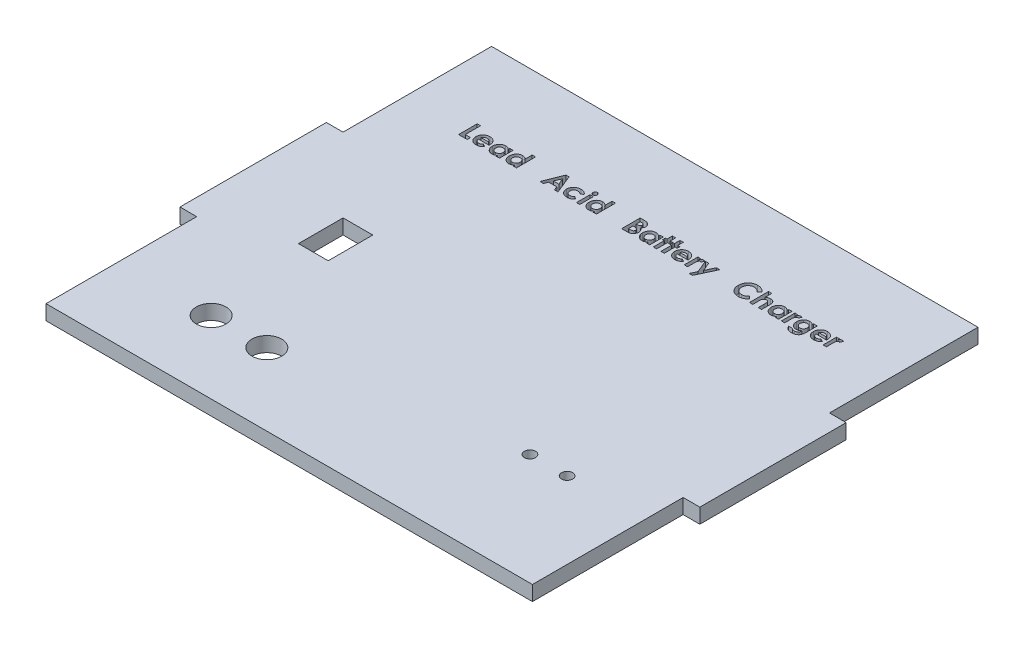
from build123d import *

# Parameters (mm, degrees)
BOSS_EXTRUDE1_DEPTH = 4
SKETCH2_R           = 1.5
SKETCH2_R_2         = 4
SKETCH2_W           = 8
SKETCH2_H           = 12
CUT_EXTRUDE1_DEPTH  = 10
SKETCH3_W           = 0.897435897
SKETCH3_H           = 3.653846154
CUT_EXTRUDE3_DEPTH  = 2


with BuildPart() as part:
    # Sketch1 → Boss-Extrude1 (new body)
    with BuildSketch(Plane(origin=(0, 0, 0), x_dir=(1, 0, 0), z_dir=(0, 1, 0))):
        Polygon((-65.5, 20), (-70, 20), (-70, -19.415515436), (-65.5, -19.415515436), (-65.5, -60), (65.5, -60), (65.5, -19.415515436), (70, -19.415515436), (70, 20), (65.5, 20), (65.5, 60), (-65.5, 60), align=None)
    extrude(amount=BOSS_EXTRUDE1_DEPTH)

    # Sketch2 → Cut-Extrude1 (cut)
    with BuildSketch(Plane(origin=(0, 4, 0), x_dir=(1, 0, 0), z_dir=(0, 1, 0))):
        with Locations(Location((34.839843286, -30, 0), (0, 0, 270))):
            Circle(SKETCH2_R)
        with Locations(Location((44.839843286, -30, 0), (0, 0, 270))):
            Circle(SKETCH2_R)
        with Locations(Location((-40.5, -40.524332807, 0), (0, 0, 270))):
            Circle(SKETCH2_R_2)
        with Locations(Location((-25.5, -40.524332807, 0), (0, 0, 270))):
            Circle(SKETCH2_R_2)
        with Locations((-41.5, -6)):
            Rectangle(SKETCH2_W, SKETCH2_H)
    extrude(amount=-CUT_EXTRUDE1_DEPTH, mode=Mode.SUBTRACT)

    # Sketch3 → Cut-Extrude3 (cut)
    # profile 1 of 23: a face of its own
    with BuildSketch(Plane(origin=(0, 4, 0), x_dir=(1, 0, 0), z_dir=(0, 1, 0))):
        Polygon((-49.378334194, 40), (-48.480898296, 40), (-48.480898296, 35.897435897), (-47.070641886, 35.897435897), (-47.070641886, 35), (-49.378334194, 35), align=None)
    # profile 2 of 23: a face of its own
    with BuildSketch(Plane(origin=(0, 4, 0), x_dir=(1, 0, 0), z_dir=(0, 1, 0))):
        with BuildLine():
            Line((-42.778774899, 36.602564103), (-45.660385476, 36.602564103))
            add(Edge.make_bspline(
                [(-45.660385476, 36.602564103), (-45.654510105, 36.569081422), (-45.642964536, 36.503285314), (-45.617892925, 36.407710758), (-45.585897788, 36.31764291), (-45.547553632, 36.23296137), (-45.503506938, 36.153218461), (-45.452130119, 36.078788209), (-45.394074843, 36.009736354), (-45.329676769, 35.946363005), (-45.260009298, 35.88957911), (-45.185410289, 35.839832829), (-45.105802763, 35.799043921), (-45.022099389, 35.764663104), (-44.93367471, 35.737430015), (-44.840398588, 35.718647871), (-44.742518283, 35.707553189), (-44.675839229, 35.705948471), (-44.641755668, 35.705128205)],
                knots=[0, 0, 0, 0, 1.091296461, 2.144483647, 3.168565212, 4.157007626, 5.126487748, 6.090021542, 7.05641414, 8.019231907, 8.98705074, 9.938580405, 10.892824166, 11.854447369, 12.841318655, 13.858982407, 14.905600794, 16, 16, 16, 16], degree=3))
            add(Edge.make_bspline(
                [(-44.641755668, 35.705128205), (-44.600614496, 35.706214372), (-44.519595413, 35.708353354), (-44.400901853, 35.727322948), (-44.286107891, 35.755975686), (-44.176299882, 35.798584712), (-44.070205872, 35.85162546), (-43.969572495, 35.917707705), (-43.872657866, 35.994900308), (-43.813528522, 36.054400337), (-43.783382271, 36.084735577)],
                knots=[0, 0, 0, 0, 1.021034703, 2.010718019, 2.977989445, 3.954245119, 4.929443971, 5.918328161, 6.938689359, 8, 8, 8, 8], degree=3))
            Line((-43.783382271, 36.084735577), (-43.032180348, 35.727163462))
            add(Edge.make_bspline(
                [(-43.032180348, 35.727163462), (-43.055831502, 35.694481196), (-43.102695394, 35.62972249), (-43.179199125, 35.538590265), (-43.25903564, 35.453560202), (-43.342264481, 35.375191557), (-43.428991202, 35.303707649), (-43.518974551, 35.238237675), (-43.613529598, 35.180539478), (-43.710765732, 35.127821653), (-43.812693003, 35.082626907), (-43.919029334, 35.044086423), (-44.029324331, 35.009246153), (-44.144970781, 34.982699776), (-44.265005697, 34.96168588), (-44.389716227, 34.946763231), (-44.519085933, 34.937546225), (-44.607017769, 34.93645356), (-44.651771694, 34.935897436)],
                knots=[0, 0, 0, 0, 1.028154879, 2.037251081, 3.030720504, 4.000128189, 4.949298328, 5.894184978, 6.834267904, 7.770992897, 8.712077017, 9.673380525, 10.653304757, 11.658697181, 12.695551717, 13.758623199, 14.859225354, 16, 16, 16, 16], degree=3))
            add(Edge.make_bspline(
                [(-44.651771694, 34.935897436), (-44.720624872, 34.937301145), (-44.855469854, 34.940050229), (-45.052705016, 34.965565658), (-45.240023714, 35.00787299), (-45.417954872, 35.065383309), (-45.585729353, 35.141314948), (-45.743430187, 35.234185642), (-45.892633033, 35.342214872), (-46.028778911, 35.467669885), (-46.152811822, 35.604220209), (-46.261754619, 35.750865933), (-46.3529164, 35.906582497), (-46.427780288, 36.070339338), (-46.485967103, 36.242555608), (-46.527916421, 36.42330646), (-46.553631856, 36.612505563), (-46.55640925, 36.741371273), (-46.557821373, 36.806891026)],
                knots=[0, 0, 0, 0, 1.103565453, 2.161269334, 3.182010356, 4.179077853, 5.15417608, 6.128274628, 7.109042802, 8.101804412, 9.090965879, 10.063106201, 11.02526161, 11.978650795, 12.945248442, 13.93468508, 14.949922959, 16, 16, 16, 16], degree=3))
            add(Edge.make_bspline(
                [(-46.557821373, 36.806891026), (-46.556395352, 36.874075719), (-46.55358972, 37.006258587), (-46.528137831, 37.199826384), (-46.485851127, 37.384516244), (-46.427494104, 37.560582503), (-46.35376591, 37.728575822), (-46.261444251, 37.887026461), (-46.152865884, 38.036486058), (-46.029279799, 38.176255427), (-45.892557166, 38.302412552), (-45.747276451, 38.414843762), (-45.591805276, 38.508528909), (-45.427902155, 38.58422645), (-45.25661547, 38.645728791), (-45.075965388, 38.686653462), (-44.88732638, 38.714131929), (-44.758376908, 38.716662524), (-44.692837399, 38.717948718)],
                knots=[0, 0, 0, 0, 1.079208495, 2.12329425, 3.130605359, 4.119693003, 5.099659317, 6.073216462, 7.060498243, 8.06384408, 9.066070512, 10.045757761, 11.010926815, 11.975797609, 12.942977511, 13.929384301, 14.947594487, 16, 16, 16, 16], degree=3))
            add(Edge.make_bspline(
                [(-44.692837399, 38.717948718), (-44.623654367, 38.716523231), (-44.487820614, 38.713724435), (-44.28921177, 38.688416185), (-44.100649298, 38.645850868), (-43.921329816, 38.58883783), (-43.753543307, 38.510988078), (-43.593602993, 38.420402785), (-43.445345151, 38.310038421), (-43.307189508, 38.185197344), (-43.182475806, 38.046690495), (-43.073462211, 37.896229636), (-42.980705059, 37.735283176), (-42.905524467, 37.563198442), (-42.847397399, 37.380492051), (-42.805409249, 37.187401282), (-42.779889962, 36.983191711), (-42.777164249, 36.843357713), (-42.775770091, 36.771834936)],
                knots=[0, 0, 0, 0, 1.080001299, 2.120471247, 3.119684163, 4.095710327, 5.052285597, 6.002875087, 6.961153713, 7.931888285, 8.906493152, 9.865905668, 10.82813294, 11.801621613, 12.7925306, 13.817193356, 14.883530496, 16, 16, 16, 16], degree=3))
            Line((-42.775770091, 36.771834936), (-42.778774899, 36.602564103))
        make_face()
        with BuildLine():
            add(Edge.make_bspline(
                [(-43.673205989, 37.307692308), (-43.690141153, 37.353393456), (-43.723812671, 37.444259244), (-43.799875229, 37.56963186), (-43.90080781, 37.678209637), (-44.018199643, 37.774334404), (-44.152327163, 37.852355269), (-44.298963776, 37.90884491), (-44.456256024, 37.942716807), (-44.564464615, 37.946689385), (-44.619720412, 37.948717949)],
                knots=[0, 0, 0, 0, 0.954238005, 1.897273737, 2.851915805, 3.847685534, 4.862635127, 5.880135777, 6.917509367, 8, 8, 8, 8], degree=3))
            add(Edge.make_bspline(
                [(-44.619720412, 37.948717949), (-44.680068738, 37.946769267), (-44.79803715, 37.942959999), (-44.968198552, 37.902447037), (-45.128707545, 37.841982652), (-45.223334551, 37.779642588), (-45.270762078, 37.748397436)],
                knots=[0, 0, 0, 0, 1.044195649, 2.041185066, 3.018232172, 4, 4, 4, 4], degree=3))
            add(Edge.make_bspline(
                [(-45.270762078, 37.748397436), (-45.300353313, 37.724600444), (-45.363440314, 37.673866474), (-45.445371583, 37.572657019), (-45.526074565, 37.45011509), (-45.57195866, 37.357035838), (-45.596282912, 37.307692308)],
                knots=[0, 0, 0, 0, 0.82159062, 1.751589201, 2.808063854, 4, 4, 4, 4], degree=3))
            Line((-45.596282912, 37.307692308), (-43.673205989, 37.307692308))
        make_face(mode=Mode.SUBTRACT)
    # profile 3 of 23: a face of its own
    with BuildSketch(Plane(origin=(0, 4, 0), x_dir=(1, 0, 0), z_dir=(0, 1, 0))):
        with BuildLine():
            Line((-39.250129066, 38.653846154), (-38.352693168, 38.653846154))
            Line((-38.352693168, 38.653846154), (-38.352693168, 35))
            Line((-38.352693168, 35), (-39.250129066, 35))
            Line((-39.250129066, 35), (-39.250129066, 35.398637821))
            add(Edge.make_bspline(
                [(-39.250129066, 35.398637821), (-39.294596684, 35.359834841), (-39.380899549, 35.28452592), (-39.516884938, 35.18681068), (-39.653267693, 35.106208236), (-39.790703135, 35.042012785), (-39.931303591, 34.994611052), (-40.076081326, 34.96029109), (-40.227121295, 34.940051768), (-40.329796185, 34.937296638), (-40.381939963, 34.935897436)],
                knots=[0, 0, 0, 0, 1.129196829, 2.191548051, 3.199897424, 4.157751732, 5.089409408, 6.034969131, 7.002052659, 8, 8, 8, 8], degree=3))
            add(Edge.make_bspline(
                [(-40.381939963, 34.935897436), (-40.440473672, 34.937214261), (-40.556139598, 34.939816383), (-40.725866503, 34.967207911), (-40.889754704, 35.009136749), (-41.047671168, 35.068471297), (-41.199328582, 35.145357238), (-41.345887584, 35.237788511), (-41.484835707, 35.349010007), (-41.617329645, 35.474209455), (-41.7386403, 35.611929739), (-41.844691221, 35.760259319), (-41.934084265, 35.917094469), (-42.007319202, 36.081915208), (-42.064927938, 36.254600565), (-42.105994723, 36.435698248), (-42.130224173, 36.625272935), (-42.133223097, 36.754403788), (-42.13474445, 36.819911859)],
                knots=[0, 0, 0, 0, 0.980476535, 1.937477201, 2.874147792, 3.812856188, 4.758993464, 5.720109578, 6.712210464, 7.737600662, 8.772720504, 9.783789959, 10.789002326, 11.793715968, 12.802552247, 13.835794126, 14.902098527, 16, 16, 16, 16], degree=3))
            add(Edge.make_bspline(
                [(-42.13474445, 36.819911859), (-42.133147784, 36.887745553), (-42.130015745, 37.020808902), (-42.107105069, 37.216073041), (-42.066796121, 37.401661026), (-42.011831972, 37.577829923), (-41.941130139, 37.74461017), (-41.85502003, 37.902275003), (-41.752330199, 38.050412314), (-41.633998372, 38.1865007), (-41.506229063, 38.311232279), (-41.369538489, 38.41982101), (-41.226064194, 38.51207219), (-41.075653709, 38.587384953), (-40.918328515, 38.645582844), (-40.754709729, 38.688130255), (-40.584070998, 38.713660196), (-40.467830512, 38.716507339), (-40.408983232, 38.717948718)],
                knots=[0, 0, 0, 0, 1.136281865, 2.228943489, 3.287578264, 4.313574083, 5.316051562, 6.317280042, 7.318008486, 8.329309503, 9.333984563, 10.305318864, 11.248632312, 12.186624717, 13.117503092, 14.05354244, 15.014596925, 16, 16, 16, 16], degree=3))
            add(Edge.make_bspline(
                [(-40.408983232, 38.717948718), (-40.354471584, 38.716816227), (-40.246612679, 38.714575436), (-40.088075631, 38.69024473), (-39.93431756, 38.653446266), (-39.786177223, 38.601015079), (-39.642439526, 38.534810039), (-39.505576847, 38.451850188), (-39.372595191, 38.355622292), (-39.291455472, 38.280466268), (-39.250129066, 38.2421875)],
                knots=[0, 0, 0, 0, 1.017011718, 2.012299608, 2.98747302, 3.965332399, 4.941441765, 5.936729654, 6.94912688, 8, 8, 8, 8], degree=3))
            Line((-39.250129066, 38.2421875), (-39.250129066, 38.653846154))
        make_face()
        with BuildLine():
            add(Edge.make_bspline(
                [(-40.22068195, 37.884615385), (-40.256442125, 37.883518139), (-40.326529733, 37.881367609), (-40.429603153, 37.868432023), (-40.528110421, 37.845638943), (-40.621348992, 37.811967062), (-40.710708462, 37.770949806), (-40.794831896, 37.719576367), (-40.874413588, 37.658854054), (-40.94898551, 37.590252953), (-41.016968804, 37.5148478), (-41.075574372, 37.432564441), (-41.125379636, 37.345619944), (-41.167501946, 37.253752898), (-41.197651963, 37.155876231), (-41.221530763, 37.053264123), (-41.233922315, 36.945078286), (-41.236168513, 36.871352987), (-41.237308553, 36.833934295)],
                knots=[0, 0, 0, 0, 1.04836806, 2.054732945, 3.03993516, 4.00574415, 4.955904794, 5.917688631, 6.888591924, 7.88601754, 8.884115178, 9.859153345, 10.841239365, 11.818093293, 12.814750328, 13.83810466, 14.90274714, 16, 16, 16, 16], degree=3))
            add(Edge.make_bspline(
                [(-41.237308553, 36.833934295), (-41.236185927, 36.796176194), (-41.233973807, 36.721774293), (-41.221330404, 36.61267587), (-41.198310861, 36.508564841), (-41.164726216, 36.410282871), (-41.123711574, 36.316503814), (-41.073787531, 36.227660467), (-41.012464588, 36.145323692), (-40.944421699, 36.067545125), (-40.868319945, 35.998091883), (-40.788287948, 35.936423781), (-40.703232533, 35.884826119), (-40.614076492, 35.843124562), (-40.521119927, 35.809141299), (-40.423197446, 35.786634682), (-40.321268322, 35.772246627), (-40.251780546, 35.770242997), (-40.21667554, 35.769230769)],
                knots=[0, 0, 0, 0, 1.099136573, 2.165835871, 3.191374663, 4.196217796, 5.183857741, 6.167377911, 7.154730987, 8.166690795, 9.170734848, 10.148332609, 11.103258353, 12.059567475, 13.009337315, 13.978056681, 14.978520572, 16, 16, 16, 16], degree=3))
            add(Edge.make_bspline(
                [(-40.21667554, 35.769230769), (-40.18024929, 35.770334166), (-40.108834038, 35.772497424), (-40.004079028, 35.785314959), (-39.904248454, 35.808191612), (-39.809757664, 35.842056272), (-39.719163403, 35.882779106), (-39.633283201, 35.933148669), (-39.553048988, 35.993731641), (-39.478054415, 36.062952898), (-39.409336346, 36.138973779), (-39.34992031, 36.222336153), (-39.298166769, 36.310373864), (-39.25746499, 36.405168443), (-39.225142069, 36.505061429), (-39.201951119, 36.610672777), (-39.189336587, 36.72211635), (-39.187143814, 36.798180931), (-39.186026501, 36.836939103)],
                knots=[0, 0, 0, 0, 1.050008698, 2.058587853, 3.036635738, 3.995319155, 4.947022481, 5.895997462, 6.858296291, 7.838991643, 8.833936038, 9.806048392, 10.784806122, 11.771666913, 12.772873988, 13.80724452, 14.882696879, 16, 16, 16, 16], degree=3))
            add(Edge.make_bspline(
                [(-39.186026501, 36.836939103), (-39.18712993, 36.875030652), (-39.189285247, 36.949434514), (-39.202005522, 37.058551198), (-39.225361115, 37.162088821), (-39.257018776, 37.2602377), (-39.298444652, 37.352773418), (-39.350237352, 37.438669975), (-39.409001628, 37.520903364), (-39.478480506, 37.5948705), (-39.553068816, 37.663590542), (-39.634483003, 37.722341441), (-39.720158077, 37.772974596), (-39.810620429, 37.814546369), (-39.906707698, 37.845020054), (-40.006708876, 37.868614714), (-40.112184188, 37.881359845), (-40.183925843, 37.883512496), (-40.22068195, 37.884615385)],
                knots=[0, 0, 0, 0, 1.106611376, 2.161533483, 3.185006901, 4.184773755, 5.152708835, 6.122342771, 7.094156588, 8.082475533, 9.064254463, 10.03606828, 10.992420271, 11.951521816, 12.920622147, 13.915721683, 14.932141191, 16, 16, 16, 16], degree=3))
        make_face(mode=Mode.SUBTRACT)
    # profile 4 of 23: a face of its own
    with BuildSketch(Plane(origin=(0, 4, 0), x_dir=(1, 0, 0), z_dir=(0, 1, 0))):
        with BuildLine():
            Line((-34.698847014, 40.128205128), (-33.801411117, 40.128205128))
            Line((-33.801411117, 40.128205128), (-33.801411117, 35))
            Line((-33.801411117, 35), (-34.698847014, 35))
            Line((-34.698847014, 35), (-34.698847014, 35.398637821))
            add(Edge.make_bspline(
                [(-34.698847014, 35.398637821), (-34.743314632, 35.359834841), (-34.829617498, 35.28452592), (-34.965602887, 35.18681068), (-35.101985642, 35.106208236), (-35.239421084, 35.042012785), (-35.38002154, 34.994611052), (-35.524799275, 34.96029109), (-35.675839244, 34.940051768), (-35.778514134, 34.937296638), (-35.830657912, 34.935897436)],
                knots=[0, 0, 0, 0, 1.129196829, 2.191548051, 3.199897424, 4.157751732, 5.089409408, 6.034969131, 7.002052659, 8, 8, 8, 8], degree=3))
            add(Edge.make_bspline(
                [(-35.830657912, 34.935897436), (-35.889191621, 34.937214261), (-36.004857546, 34.939816383), (-36.174584452, 34.967207911), (-36.338472652, 35.009136749), (-36.496389117, 35.068471297), (-36.648046531, 35.145357238), (-36.794605533, 35.237788511), (-36.933553655, 35.349010007), (-37.066047594, 35.474209455), (-37.187358249, 35.611929739), (-37.293409169, 35.760259319), (-37.382802213, 35.917094469), (-37.456037151, 36.081915208), (-37.513645887, 36.254600565), (-37.554712672, 36.435698248), (-37.578942122, 36.625272935), (-37.581941045, 36.754403788), (-37.583462399, 36.819911859)],
                knots=[0, 0, 0, 0, 0.980476535, 1.937477201, 2.874147792, 3.812856188, 4.758993464, 5.720109578, 6.712210464, 7.737600662, 8.772720504, 9.783789959, 10.789002326, 11.793715968, 12.802552247, 13.835794126, 14.902098527, 16, 16, 16, 16], degree=3))
            add(Edge.make_bspline(
                [(-37.583462399, 36.819911859), (-37.581865733, 36.887745553), (-37.578733694, 37.020808902), (-37.555823018, 37.216073041), (-37.51551407, 37.401661026), (-37.460549921, 37.577829923), (-37.389848088, 37.74461017), (-37.303737979, 37.902275003), (-37.201048147, 38.050412314), (-37.08271632, 38.1865007), (-36.954947011, 38.311232279), (-36.818256438, 38.41982101), (-36.674782142, 38.51207219), (-36.524371658, 38.587384953), (-36.367046464, 38.645582844), (-36.203427677, 38.688130255), (-36.032788947, 38.713660196), (-35.916548461, 38.716507339), (-35.857701181, 38.717948718)],
                knots=[0, 0, 0, 0, 1.136281865, 2.228943489, 3.287578264, 4.313574083, 5.316051562, 6.317280042, 7.318008486, 8.329309503, 9.333984563, 10.305318864, 11.248632312, 12.186624717, 13.117503092, 14.05354244, 15.014596925, 16, 16, 16, 16], degree=3))
            add(Edge.make_bspline(
                [(-35.857701181, 38.717948718), (-35.803224675, 38.716220351), (-35.695497383, 38.712802506), (-35.536365615, 38.69128802), (-35.383250633, 38.650778122), (-35.234292859, 38.598584096), (-35.091426796, 38.528348739), (-34.953884889, 38.443979263), (-34.821304738, 38.344404194), (-34.740182294, 38.267401274), (-34.698847014, 38.228165064)],
                knots=[0, 0, 0, 0, 1.011899165, 2.001030639, 2.974036179, 3.948778736, 4.92769327, 5.924124564, 6.942254589, 8, 8, 8, 8], degree=3))
            Line((-34.698847014, 38.228165064), (-34.698847014, 40.128205128))
        make_face()
        with BuildLine():
            add(Edge.make_bspline(
                [(-35.669399899, 37.884615385), (-35.705160074, 37.883518139), (-35.775247682, 37.881367609), (-35.878321101, 37.868432023), (-35.97682837, 37.845638943), (-36.070066941, 37.811967062), (-36.159426411, 37.770949806), (-36.243549845, 37.719576367), (-36.323131536, 37.658854054), (-36.397703459, 37.590252953), (-36.465686753, 37.5148478), (-36.524292321, 37.432564441), (-36.574097585, 37.345619944), (-36.616219895, 37.253752898), (-36.646369911, 37.155876231), (-36.670248712, 37.053264123), (-36.682640264, 36.945078286), (-36.684886462, 36.871352987), (-36.686026501, 36.833934295)],
                knots=[0, 0, 0, 0, 1.04836806, 2.054732945, 3.03993516, 4.00574415, 4.955904794, 5.917688631, 6.888591924, 7.88601754, 8.884115178, 9.859153345, 10.841239365, 11.818093293, 12.814750328, 13.83810466, 14.90274714, 16, 16, 16, 16], degree=3))
            add(Edge.make_bspline(
                [(-36.686026501, 36.833934295), (-36.684903876, 36.796176194), (-36.682691756, 36.721774293), (-36.670048353, 36.61267587), (-36.64702881, 36.508564841), (-36.613444165, 36.410282871), (-36.572429522, 36.316503814), (-36.522505479, 36.227660467), (-36.461182537, 36.145323692), (-36.393139647, 36.067545125), (-36.317037894, 35.998091883), (-36.237005897, 35.936423781), (-36.151950482, 35.884826119), (-36.06279444, 35.843124562), (-35.969837876, 35.809141299), (-35.871915394, 35.786634682), (-35.76998627, 35.772246627), (-35.700498495, 35.770242997), (-35.665393489, 35.769230769)],
                knots=[0, 0, 0, 0, 1.099136573, 2.165835871, 3.191374663, 4.196217796, 5.183857741, 6.167377911, 7.154730987, 8.166690795, 9.170734848, 10.148332609, 11.103258353, 12.059567475, 13.009337315, 13.978056681, 14.978520572, 16, 16, 16, 16], degree=3))
            add(Edge.make_bspline(
                [(-35.665393489, 35.769230769), (-35.628967239, 35.770334166), (-35.557551986, 35.772497424), (-35.452796976, 35.785314959), (-35.352966402, 35.808191612), (-35.258475613, 35.842056272), (-35.167881351, 35.882779106), (-35.08200115, 35.933148669), (-35.001766937, 35.993731641), (-34.926772364, 36.062952898), (-34.858054295, 36.138973779), (-34.798638259, 36.222336153), (-34.746884717, 36.310373864), (-34.706182938, 36.405168443), (-34.673860018, 36.505061429), (-34.650669068, 36.610672777), (-34.638054536, 36.72211635), (-34.635861762, 36.798180931), (-34.63474445, 36.836939103)],
                knots=[0, 0, 0, 0, 1.050008698, 2.058587853, 3.036635738, 3.995319155, 4.947022481, 5.895997462, 6.858296291, 7.838991643, 8.833936038, 9.806048392, 10.784806122, 11.771666913, 12.772873988, 13.80724452, 14.882696879, 16, 16, 16, 16], degree=3))
            add(Edge.make_bspline(
                [(-34.63474445, 36.836939103), (-34.635847879, 36.875030652), (-34.638003195, 36.949434514), (-34.650723471, 37.058551198), (-34.674079064, 37.162088821), (-34.705736725, 37.2602377), (-34.747162601, 37.352773418), (-34.798955301, 37.438669975), (-34.857719577, 37.520903364), (-34.927198455, 37.5948705), (-35.001786765, 37.663590542), (-35.083200952, 37.722341441), (-35.168876026, 37.772974596), (-35.259338377, 37.814546369), (-35.355425646, 37.845020054), (-35.455426824, 37.868614714), (-35.560902137, 37.881359845), (-35.632643791, 37.883512496), (-35.669399899, 37.884615385)],
                knots=[0, 0, 0, 0, 1.106611376, 2.161533483, 3.185006901, 4.184773755, 5.152708835, 6.122342771, 7.094156588, 8.082475533, 9.064254463, 10.03606828, 10.992420271, 11.951521816, 12.920622147, 13.915721683, 14.932141191, 16, 16, 16, 16], degree=3))
        make_face(mode=Mode.SUBTRACT)
    # profile 5 of 23: a face of its own
    with BuildSketch(Plane(origin=(0, 4, 0), x_dir=(1, 0, 0), z_dir=(0, 1, 0))):
        Polygon((-25.467076181, 40), (-24.63474445, 40), (-22.615513681, 35), (-23.574047335, 35), (-23.96266913, 36.025641026), (-26.141154707, 36.025641026), (-26.529776501, 35), (-27.487308553, 35), align=None)
        Polygon((-25.051411117, 38.658854167), (-25.800609835, 36.923076923), (-24.302212399, 36.923076923), align=None, mode=Mode.SUBTRACT)
    # profile 6 of 23: a face of its own
    with BuildSketch(Plane(origin=(0, 4, 0), x_dir=(1, 0, 0), z_dir=(0, 1, 0))):
        with BuildLine():
            Line((-18.480898296, 37.908653846), (-19.224087399, 37.5))
            add(Edge.make_bspline(
                [(-19.224087399, 37.5), (-19.258152479, 37.534113176), (-19.323634126, 37.599687277), (-19.428639211, 37.682693685), (-19.531767993, 37.751420682), (-19.637272044, 37.802137676), (-19.746094447, 37.840332433), (-19.862160292, 37.86562966), (-19.986824272, 37.882286985), (-20.07305449, 37.883823249), (-20.117516886, 37.884615385)],
                knots=[0, 0, 0, 0, 1.150764855, 2.212059359, 3.192108068, 4.105322427, 5.000809612, 5.941206042, 6.938435785, 8, 8, 8, 8], degree=3))
            add(Edge.make_bspline(
                [(-20.117516886, 37.884615385), (-20.158291972, 37.883630516), (-20.238085396, 37.88170321), (-20.354676251, 37.867307558), (-20.465483911, 37.844697479), (-20.570309471, 37.811618853), (-20.668966225, 37.767920189), (-20.762270023, 37.716209392), (-20.849314197, 37.65446671), (-20.928868353, 37.583569799), (-21.000679963, 37.505513871), (-21.064739582, 37.422263869), (-21.117219538, 37.3325848), (-21.162591715, 37.238584446), (-21.195949893, 37.13849727), (-21.220355547, 37.03323146), (-21.234266543, 36.922782353), (-21.236282001, 36.847326743), (-21.237308553, 36.808894231)],
                knots=[0, 0, 0, 0, 1.121765476, 2.195200973, 3.227634963, 4.230038321, 5.213228299, 6.192116585, 7.160777141, 8.14345191, 9.118668839, 10.075979138, 11.027630062, 11.972829041, 12.943187208, 13.923755399, 14.94248691, 16, 16, 16, 16], degree=3))
            add(Edge.make_bspline(
                [(-21.237308553, 36.808894231), (-21.236223912, 36.771464681), (-21.234106075, 36.698380833), (-21.221094796, 36.591003245), (-21.198506725, 36.488784363), (-21.16463887, 36.392264588), (-21.12404446, 36.300554146), (-21.073065312, 36.214382427), (-21.013116643, 36.133373142), (-20.943882846, 36.058230379), (-20.867189369, 35.990648683), (-20.784507787, 35.930967049), (-20.696084788, 35.880368065), (-20.600890332, 35.840659234), (-20.50047647, 35.808304844), (-20.394172633, 35.785267251), (-20.282091947, 35.772479794), (-20.205689381, 35.770330519), (-20.166595412, 35.769230769)],
                knots=[0, 0, 0, 0, 1.070556293, 2.090336998, 3.088792742, 4.058148387, 5.011235098, 5.952916408, 6.915475435, 7.888633318, 8.869583867, 9.83422472, 10.800707077, 11.776204622, 12.778807041, 13.814557445, 14.881744048, 16, 16, 16, 16], degree=3))
            add(Edge.make_bspline(
                [(-20.166595412, 35.769230769), (-20.118461366, 35.770332217), (-20.024510702, 35.772482083), (-19.887933702, 35.790716555), (-19.759416615, 35.820869958), (-19.63894581, 35.862604664), (-19.526689829, 35.91717357), (-19.422937105, 35.983825417), (-19.326621064, 36.062068525), (-19.270454854, 36.123068615), (-19.242116245, 36.153846154)],
                knots=[0, 0, 0, 0, 1.116373375, 2.178998604, 3.189797796, 4.174590301, 5.13072713, 6.078291395, 7.030403691, 8, 8, 8, 8], degree=3))
            Line((-19.242116245, 36.153846154), (-18.54500086, 35.675080128))
            add(Edge.make_bspline(
                [(-18.54500086, 35.675080128), (-18.593321551, 35.616001974), (-18.688678758, 35.49941573), (-18.855050643, 35.349140316), (-19.034117042, 35.220020345), (-19.229479368, 35.11695842), (-19.438292499, 35.034985834), (-19.66218811, 34.977039354), (-19.900787497, 34.942928731), (-20.064653357, 34.938278664), (-20.148566566, 34.935897436)],
                knots=[0, 0, 0, 0, 0.997876357, 1.969233105, 2.924898516, 3.881013542, 4.852507933, 5.855329832, 6.901747111, 8, 8, 8, 8], degree=3))
            add(Edge.make_bspline(
                [(-20.148566566, 34.935897436), (-20.224093657, 34.937643398), (-20.371606395, 34.941053455), (-20.586602546, 34.967168056), (-20.78881759, 35.011154547), (-20.978667514, 35.072242743), (-21.155979231, 35.15137483), (-21.320177702, 35.249528186), (-21.472370444, 35.363972542), (-21.609811288, 35.495248527), (-21.732440056, 35.638143855), (-21.839495413, 35.788635355), (-21.932081783, 35.944026657), (-22.0047157, 36.10690419), (-22.064077629, 36.274729231), (-22.104168812, 36.44950789), (-22.130611416, 36.629800492), (-22.133355684, 36.752041065), (-22.13474445, 36.813902244)],
                knots=[0, 0, 0, 0, 1.183377041, 2.311265848, 3.387807024, 4.421911742, 5.431260577, 6.423665966, 7.413571885, 8.409103097, 9.395976332, 10.359992013, 11.300391101, 12.225292883, 13.150239058, 14.085544813, 15.031169026, 16, 16, 16, 16], degree=3))
            add(Edge.make_bspline(
                [(-22.13474445, 36.813902244), (-22.134000478, 36.857001451), (-22.132526897, 36.942367729), (-22.119947181, 37.069146173), (-22.10037737, 37.193773236), (-22.070966253, 37.315374104), (-22.034795772, 37.434538738), (-21.990825654, 37.551243186), (-21.937321556, 37.664885232), (-21.877637572, 37.776431583), (-21.809614453, 37.882937582), (-21.73540264, 37.98435622), (-21.655106692, 38.080066356), (-21.567783335, 38.169175998), (-21.474041443, 38.25232276), (-21.375243779, 38.331193536), (-21.268193299, 38.40172078), (-21.156611492, 38.468029416), (-21.039537195, 38.527056873), (-20.918316017, 38.57800535), (-20.793884728, 38.62129343), (-20.66594507, 38.65609792), (-20.535046189, 38.6847832), (-20.400023314, 38.702988058), (-20.261993533, 38.715783862), (-20.168629003, 38.717222749), (-20.121523296, 38.717948718)],
                knots=[0, 0, 0, 0, 1.00272354, 1.986087015, 2.96193297, 3.936200312, 4.894695956, 5.858592327, 6.835334787, 7.815655071, 8.800643866, 9.773423113, 10.738352213, 11.705312252, 12.673769326, 13.65298065, 14.64420052, 15.654211674, 16.672258995, 17.692438602, 18.712115155, 19.735602823, 20.776372304, 21.827874031, 22.90408564, 24, 24, 24, 24], degree=3))
            add(Edge.make_bspline(
                [(-20.121523296, 38.717948718), (-20.077768138, 38.717454029), (-19.991473714, 38.716478397), (-19.864036357, 38.70627681), (-19.740075231, 38.688948965), (-19.619379379, 38.666024957), (-19.501582249, 38.637618119), (-19.388262634, 38.599752755), (-19.277871265, 38.556776993), (-19.135686016, 38.491888079), (-18.968075631, 38.395030873), (-18.784084333, 38.256116288), (-18.620033818, 38.093606485), (-18.52752331, 37.970632407), (-18.480898296, 37.908653846)],
                knots=[0, 0, 0, 0, 0.826738014, 1.630502179, 2.413926014, 3.191023582, 3.95155221, 4.701751672, 5.446919844, 6.189438973, 7.653650558, 9.094719814, 10.535747635, 12, 12, 12, 12], degree=3))
        make_face()
    # profile 7 of 23: a face of its own
    with BuildSketch(Plane(origin=(0, 4, 0), x_dir=(1, 0, 0), z_dir=(0, 1, 0))):
        with BuildLine():
            add(Edge.make_bspline(
                [(-17.200850219, 40.192307692), (-17.162170738, 40.190409931), (-17.086219851, 40.186683493), (-16.97740987, 40.150359012), (-16.877544359, 40.093348824), (-16.789260478, 40.015129488), (-16.715834201, 39.921721294), (-16.659733798, 39.817144611), (-16.628482601, 39.701277014), (-16.624142272, 39.62123689), (-16.621923937, 39.580328526)],
                knots=[0, 0, 0, 0, 0.989868614, 1.943702388, 2.910836514, 3.924849579, 4.949916355, 5.946401046, 6.950409252, 8, 8, 8, 8], degree=3))
            add(Edge.make_bspline(
                [(-16.621923937, 39.580328526), (-16.624062903, 39.539721634), (-16.628230781, 39.460597171), (-16.660453064, 39.34630253), (-16.714301791, 39.24177664), (-16.788322775, 39.149755731), (-16.875649544, 39.072796164), (-16.973332917, 39.014750991), (-17.081100183, 38.980447233), (-17.155872542, 38.976409285), (-17.193839001, 38.974358974)],
                knots=[0, 0, 0, 0, 1.05296456, 2.051751585, 3.055639087, 4.085634717, 5.099016424, 6.062201612, 7.016062274, 8, 8, 8, 8], degree=3))
            add(Edge.make_bspline(
                [(-17.193839001, 38.974358974), (-17.232856122, 38.976249952), (-17.309467779, 38.979962961), (-17.419170226, 39.016372433), (-17.520367688, 39.072933628), (-17.608268594, 39.152751107), (-17.682535766, 39.246823036), (-17.736185681, 39.353834355), (-17.76974503, 39.470494252), (-17.773728495, 39.551719825), (-17.775770091, 39.593349359)],
                knots=[0, 0, 0, 0, 0.989065327, 1.942068821, 2.907541208, 3.917690034, 4.939857478, 5.938239964, 6.943311734, 8, 8, 8, 8], degree=3))
            add(Edge.make_bspline(
                [(-17.775770091, 39.593349359), (-17.773548277, 39.633266722), (-17.769183843, 39.711678618), (-17.737745447, 39.824970139), (-17.682931425, 39.927788725), (-17.610034045, 40.019486994), (-17.522525593, 40.096247245), (-17.422720033, 40.151525996), (-17.314642346, 40.186350173), (-17.239172581, 40.190301348), (-17.200850219, 40.192307692)],
                knots=[0, 0, 0, 0, 1.038616768, 2.040212704, 3.031499824, 4.052181184, 5.074969369, 6.039807101, 7.004644834, 8, 8, 8, 8], degree=3))
        make_face()
    # profile 8 of 23: a face of its own
    with BuildSketch(Plane(origin=(0, 4, 0), x_dir=(1, 0, 0), z_dir=(0, 1, 0))):
        with Locations((-17.198847015, 36.826923077)):
            Rectangle(SKETCH3_W, SKETCH3_H)
    # profile 9 of 23: a face of its own
    with BuildSketch(Plane(origin=(0, 4, 0), x_dir=(1, 0, 0), z_dir=(0, 1, 0))):
        with BuildLine():
            Line((-13.160385476, 40.128205128), (-12.262949578, 40.128205128))
            Line((-12.262949578, 40.128205128), (-12.262949578, 35))
            Line((-12.262949578, 35), (-13.160385476, 35))
            Line((-13.160385476, 35), (-13.160385476, 35.398637821))
            add(Edge.make_bspline(
                [(-13.160385476, 35.398637821), (-13.204853094, 35.359834841), (-13.291155959, 35.28452592), (-13.427141349, 35.18681068), (-13.563524103, 35.106208236), (-13.700959546, 35.042012785), (-13.841560001, 34.994611052), (-13.986337737, 34.96029109), (-14.137377705, 34.940051768), (-14.240052595, 34.937296638), (-14.292196373, 34.935897436)],
                knots=[0, 0, 0, 0, 1.129196829, 2.191548051, 3.199897424, 4.157751732, 5.089409408, 6.034969131, 7.002052659, 8, 8, 8, 8], degree=3))
            add(Edge.make_bspline(
                [(-14.292196373, 34.935897436), (-14.350730082, 34.937214261), (-14.466396008, 34.939816383), (-14.636122913, 34.967207911), (-14.800011114, 35.009136749), (-14.957927578, 35.068471297), (-15.109584992, 35.145357238), (-15.256143994, 35.237788511), (-15.395092117, 35.349010007), (-15.527586055, 35.474209455), (-15.648896711, 35.611929739), (-15.754947631, 35.760259319), (-15.844340675, 35.917094469), (-15.917575612, 36.081915208), (-15.975184348, 36.254600565), (-16.016251133, 36.435698248), (-16.040480584, 36.625272935), (-16.043479507, 36.754403788), (-16.04500086, 36.819911859)],
                knots=[0, 0, 0, 0, 0.980476535, 1.937477201, 2.874147792, 3.812856188, 4.758993464, 5.720109578, 6.712210464, 7.737600662, 8.772720504, 9.783789959, 10.789002326, 11.793715968, 12.802552247, 13.835794126, 14.902098527, 16, 16, 16, 16], degree=3))
            add(Edge.make_bspline(
                [(-16.04500086, 36.819911859), (-16.043404194, 36.887745553), (-16.040272155, 37.020808902), (-16.01736148, 37.216073041), (-15.977052531, 37.401661026), (-15.922088382, 37.577829923), (-15.851386549, 37.74461017), (-15.76527644, 37.902275003), (-15.662586609, 38.050412314), (-15.544254782, 38.1865007), (-15.416485473, 38.311232279), (-15.2797949, 38.41982101), (-15.136320604, 38.51207219), (-14.985910119, 38.587384953), (-14.828584925, 38.645582844), (-14.664966139, 38.688130255), (-14.494327408, 38.713660196), (-14.378086922, 38.716507339), (-14.319239642, 38.717948718)],
                knots=[0, 0, 0, 0, 1.136281865, 2.228943489, 3.287578264, 4.313574083, 5.316051562, 6.317280042, 7.318008486, 8.329309503, 9.333984563, 10.305318864, 11.248632312, 12.186624717, 13.117503092, 14.05354244, 15.014596925, 16, 16, 16, 16], degree=3))
            add(Edge.make_bspline(
                [(-14.319239642, 38.717948718), (-14.264763137, 38.716220351), (-14.157035844, 38.712802506), (-13.997904077, 38.69128802), (-13.844789094, 38.650778122), (-13.695831321, 38.598584096), (-13.552965258, 38.528348739), (-13.415423351, 38.443979263), (-13.282843199, 38.344404194), (-13.201720756, 38.267401274), (-13.160385476, 38.228165064)],
                knots=[0, 0, 0, 0, 1.011899165, 2.001030639, 2.974036179, 3.948778736, 4.92769327, 5.924124564, 6.942254589, 8, 8, 8, 8], degree=3))
            Line((-13.160385476, 38.228165064), (-13.160385476, 40.128205128))
        make_face()
        with BuildLine():
            add(Edge.make_bspline(
                [(-14.13093836, 37.884615385), (-14.166698535, 37.883518139), (-14.236786144, 37.881367609), (-14.339859563, 37.868432023), (-14.438366831, 37.845638943), (-14.531605402, 37.811967062), (-14.620964873, 37.770949806), (-14.705088306, 37.719576367), (-14.784669998, 37.658854054), (-14.85924192, 37.590252953), (-14.927225215, 37.5148478), (-14.985830782, 37.432564441), (-15.035636047, 37.345619944), (-15.077758356, 37.253752898), (-15.107908373, 37.155876231), (-15.131787174, 37.053264123), (-15.144178725, 36.945078286), (-15.146424923, 36.871352987), (-15.147564963, 36.833934295)],
                knots=[0, 0, 0, 0, 1.04836806, 2.054732945, 3.03993516, 4.00574415, 4.955904794, 5.917688631, 6.888591924, 7.88601754, 8.884115178, 9.859153345, 10.841239365, 11.818093293, 12.814750328, 13.83810466, 14.90274714, 16, 16, 16, 16], degree=3))
            add(Edge.make_bspline(
                [(-15.147564963, 36.833934295), (-15.146442338, 36.796176194), (-15.144230217, 36.721774293), (-15.131586814, 36.61267587), (-15.108567271, 36.508564841), (-15.074982626, 36.410282871), (-15.033967984, 36.316503814), (-14.984043941, 36.227660467), (-14.922720998, 36.145323692), (-14.854678109, 36.067545125), (-14.778576356, 35.998091883), (-14.698544358, 35.936423781), (-14.613488943, 35.884826119), (-14.524332902, 35.843124562), (-14.431376337, 35.809141299), (-14.333453856, 35.786634682), (-14.231524732, 35.772246627), (-14.162036957, 35.770242997), (-14.12693195, 35.769230769)],
                knots=[0, 0, 0, 0, 1.099136573, 2.165835871, 3.191374663, 4.196217796, 5.183857741, 6.167377911, 7.154730987, 8.166690795, 9.170734848, 10.148332609, 11.103258353, 12.059567475, 13.009337315, 13.978056681, 14.978520572, 16, 16, 16, 16], degree=3))
            add(Edge.make_bspline(
                [(-14.12693195, 35.769230769), (-14.0905057, 35.770334166), (-14.019090448, 35.772497424), (-13.914335438, 35.785314959), (-13.814504864, 35.808191612), (-13.720014074, 35.842056272), (-13.629419813, 35.882779106), (-13.543539611, 35.933148669), (-13.463305398, 35.993731641), (-13.388310826, 36.062952898), (-13.319592757, 36.138973779), (-13.26017672, 36.222336153), (-13.208423179, 36.310373864), (-13.1677214, 36.405168443), (-13.135398479, 36.505061429), (-13.112207529, 36.610672777), (-13.099592997, 36.72211635), (-13.097400224, 36.798180931), (-13.096282912, 36.836939103)],
                knots=[0, 0, 0, 0, 1.050008698, 2.058587853, 3.036635738, 3.995319155, 4.947022481, 5.895997462, 6.858296291, 7.838991643, 8.833936038, 9.806048392, 10.784806122, 11.771666913, 12.772873988, 13.80724452, 14.882696879, 16, 16, 16, 16], degree=3))
            add(Edge.make_bspline(
                [(-13.096282912, 36.836939103), (-13.09738634, 36.875030652), (-13.099541657, 36.949434514), (-13.112261933, 37.058551198), (-13.135617525, 37.162088821), (-13.167275187, 37.2602377), (-13.208701063, 37.352773418), (-13.260493762, 37.438669975), (-13.319258039, 37.520903364), (-13.388736916, 37.5948705), (-13.463325226, 37.663590542), (-13.544739413, 37.722341441), (-13.630414488, 37.772974596), (-13.720876839, 37.814546369), (-13.816964108, 37.845020054), (-13.916965286, 37.868614714), (-14.022440598, 37.881359845), (-14.094182253, 37.883512496), (-14.13093836, 37.884615385)],
                knots=[0, 0, 0, 0, 1.106611376, 2.161533483, 3.185006901, 4.184773755, 5.152708835, 6.122342771, 7.094156588, 8.082475533, 9.064254463, 10.03606828, 10.992420271, 11.951521816, 12.920622147, 13.915721683, 14.932141191, 16, 16, 16, 16], degree=3))
        make_face(mode=Mode.SUBTRACT)
    # profile 10 of 23: a face of its own
    with BuildSketch(Plane(origin=(0, 4, 0), x_dir=(1, 0, 0), z_dir=(0, 1, 0))):
        with BuildLine():
            Line((-5.468077784, 35), (-5.468077784, 40))
            Line((-5.468077784, 40), (-4.666795732, 40))
            add(Edge.make_bspline(
                [(-4.666795732, 40), (-4.610700978, 40.000006402), (-4.502158693, 40.000018789), (-4.345560503, 39.994519575), (-4.200328906, 39.987405725), (-4.066926087, 39.979446981), (-3.945124984, 39.965732476), (-3.835110816, 39.951278885), (-3.736663773, 39.933848746), (-3.675799316, 39.918213371), (-3.647164322, 39.910857372)],
                knots=[0, 0, 0, 0, 1.311965854, 2.538629056, 3.664479157, 4.713267157, 5.663616078, 6.530575999, 7.308677837, 8, 8, 8, 8], degree=3))
            add(Edge.make_bspline(
                [(-3.647164322, 39.910857372), (-3.609563667, 39.900481604), (-3.535779111, 39.880121018), (-3.430096081, 39.839001933), (-3.329840985, 39.793295155), (-3.235136232, 39.741152269), (-3.146563347, 39.681943766), (-3.064458936, 39.615199748), (-2.987052211, 39.543599318), (-2.917091708, 39.465146992), (-2.853858941, 39.382247577), (-2.798921003, 39.294922795), (-2.751186976, 39.204507899), (-2.712987251, 39.109865077), (-2.684204477, 39.011430186), (-2.663152875, 38.909623557), (-2.649508587, 38.80412305), (-2.648219381, 38.732347606), (-2.647564963, 38.695913462)],
                knots=[0, 0, 0, 0, 1.099996261, 2.158545794, 3.195537121, 4.207578794, 5.205712374, 6.197378256, 7.190519799, 8.17788031, 9.159561366, 10.129234751, 11.085776129, 12.040971148, 13.00380137, 13.975669004, 14.972423361, 16, 16, 16, 16], degree=3))
            add(Edge.make_bspline(
                [(-2.647564963, 38.695913462), (-2.649276071, 38.649105149), (-2.652644177, 38.556968736), (-2.674159869, 38.421637016), (-2.714505143, 38.293729088), (-2.767295953, 38.170887658), (-2.83907495, 38.053570926), (-2.930220394, 37.941834673), (-3.039256028, 37.83223837), (-3.122892377, 37.76654278), (-3.166395091, 37.732371795)],
                knots=[0, 0, 0, 0, 0.986156485, 1.941127874, 2.875419072, 3.804401753, 4.751181392, 5.761612777, 6.835722519, 8, 8, 8, 8], degree=3))
            add(Edge.make_bspline(
                [(-3.166395091, 37.732371795), (-3.131142579, 37.714375693), (-3.062022156, 37.679090316), (-2.963891461, 37.62109169), (-2.873033149, 37.559402796), (-2.78903984, 37.495264838), (-2.713673388, 37.425958916), (-2.643821787, 37.355478533), (-2.582931152, 37.279785455), (-2.528480911, 37.201577527), (-2.481153646, 37.119722291), (-2.439936818, 37.034357981), (-2.405122441, 36.945192973), (-2.375640727, 36.852681047), (-2.353653256, 36.756504003), (-2.339316958, 36.656627446), (-2.328340191, 36.553392004), (-2.327486302, 36.483070599), (-2.327052142, 36.447315705)],
                knots=[0, 0, 0, 0, 1.164658916, 2.283573913, 3.35186032, 4.395461096, 5.390182219, 6.362969632, 7.312859996, 8.245001507, 9.165155236, 10.092416118, 11.032087915, 11.979892451, 12.947605196, 13.931445124, 14.948243989, 16, 16, 16, 16], degree=3))
            add(Edge.make_bspline(
                [(-2.327052142, 36.447315705), (-2.329869549, 36.379025902), (-2.335429689, 36.244256249), (-2.376082718, 36.046383447), (-2.446562154, 35.858782084), (-2.541201504, 35.682197767), (-2.657815391, 35.521742324), (-2.79188792, 35.381184748), (-2.942069288, 35.26220588), (-3.080629752, 35.181904375), (-3.200473642, 35.128014556), (-3.299738097, 35.094696471), (-3.406346017, 35.063830648), (-3.522250204, 35.042156029), (-3.645349473, 35.022317035), (-3.776844049, 35.010068029), (-3.916488171, 35.00176718), (-4.012401791, 35.000600969), (-4.061827784, 35)],
                knots=[0, 0, 0, 0, 1.284142165, 2.534249414, 3.780121997, 5.041676246, 6.291546858, 7.49970053, 8.684500223, 9.883330709, 10.50184324, 11.153274765, 11.851151195, 12.587658647, 13.369265475, 14.195992086, 15.070362669, 16, 16, 16, 16], degree=3))
            Line((-4.061827784, 35), (-5.468077784, 35))
        make_face()
        with BuildLine():
            Line((-4.570641886, 39.102564103), (-4.570641886, 38.012820513))
            Line((-4.570641886, 38.012820513), (-4.332260476, 38.012820513))
            add(Edge.make_bspline(
                [(-4.332260476, 38.012820513), (-4.2998623, 38.013103037), (-4.237319584, 38.013648433), (-4.146983263, 38.020672946), (-4.062985074, 38.032657202), (-3.985643603, 38.049378254), (-3.914238386, 38.070611551), (-3.849225581, 38.09615978), (-3.790891036, 38.127331397), (-3.723119788, 38.173762896), (-3.651480691, 38.242088926), (-3.5884176, 38.340800032), (-3.55127386, 38.454317429), (-3.547137049, 38.534378687), (-3.54500086, 38.575721154)],
                knots=[0, 0, 0, 0, 1.065314748, 2.056525647, 2.977365736, 3.853934255, 4.656397591, 5.425096493, 6.14721249, 6.826394842, 8.123232004, 9.372140726, 10.643011755, 12, 12, 12, 12], degree=3))
            add(Edge.make_bspline(
                [(-3.54500086, 38.575721154), (-3.546710203, 38.614445243), (-3.550015147, 38.689316714), (-3.587414117, 38.794442927), (-3.645502111, 38.887606268), (-3.714083153, 38.951368955), (-3.77866553, 38.994916991), (-3.833964925, 39.023591518), (-3.894660163, 39.049260661), (-3.961926239, 39.068887914), (-4.035379027, 39.083615514), (-4.114661726, 39.094431172), (-4.199911126, 39.101792768), (-4.258793068, 39.102301476), (-4.289191566, 39.102564103)],
                knots=[0, 0, 0, 0, 1.347982417, 2.606269829, 3.849316587, 5.153353503, 5.842674298, 6.568177932, 7.326619318, 8.142485038, 9.012069166, 9.942760135, 10.937925643, 12, 12, 12, 12], degree=3))
            Line((-4.289191566, 39.102564103), (-4.570641886, 39.102564103))
        make_face(mode=Mode.SUBTRACT)
        with BuildLine():
            Line((-4.570641886, 37.179487179), (-4.570641886, 35.897435897))
            Line((-4.570641886, 35.897435897), (-4.312228425, 35.897435897))
            add(Edge.make_bspline(
                [(-4.312228425, 35.897435897), (-4.261139754, 35.897727765), (-4.16291541, 35.898288917), (-4.022209212, 35.905068968), (-3.894272101, 35.917288815), (-3.779443062, 35.93254431), (-3.677546214, 35.953213119), (-3.588925992, 35.979490862), (-3.512367084, 36.008400955), (-3.448328541, 36.044108353), (-3.396012721, 36.085662909), (-3.348803177, 36.128132664), (-3.310311458, 36.177125539), (-3.279856091, 36.230538405), (-3.253497025, 36.287044448), (-3.237599097, 36.34885021), (-3.225494973, 36.414123914), (-3.224828851, 36.459272324), (-3.22448804, 36.482371795)],
                knots=[0, 0, 0, 0, 1.753078804, 3.370512758, 4.83203934, 6.162291463, 7.344201807, 8.395507345, 9.331626367, 10.147333109, 10.898971645, 11.62040215, 12.321813352, 13.025280112, 13.727906689, 14.453419512, 15.208716525, 16, 16, 16, 16], degree=3))
            add(Edge.make_bspline(
                [(-3.22448804, 36.482371795), (-3.225239626, 36.508786403), (-3.226703513, 36.560234954), (-3.238659099, 36.635432501), (-3.260386304, 36.705634401), (-3.287752778, 36.772635811), (-3.325834682, 36.834037846), (-3.371093722, 36.8919654), (-3.425778197, 36.944456864), (-3.487274079, 36.994687121), (-3.559002938, 37.038666432), (-3.640998425, 37.076826274), (-3.733705985, 37.108695969), (-3.837412791, 37.134070641), (-3.951664198, 37.155605775), (-4.077294117, 37.168464627), (-4.213256258, 37.17802832), (-4.30753462, 37.178989843), (-4.356298937, 37.179487179)],
                knots=[0, 0, 0, 0, 0.845221588, 1.646264278, 2.427170338, 3.19324141, 3.95557735, 4.731569926, 5.540061037, 6.376114724, 7.268642756, 8.224665384, 9.265483498, 10.400594375, 11.639216012, 12.983232105, 14.439614077, 16, 16, 16, 16], degree=3))
            Line((-4.356298937, 37.179487179), (-4.570641886, 37.179487179))
        make_face(mode=Mode.SUBTRACT)
    # profile 11 of 23: a face of its own
    with BuildSketch(Plane(origin=(0, 4, 0), x_dir=(1, 0, 0), z_dir=(0, 1, 0))):
        with BuildLine():
            Line((1.198588883, 38.653846154), (2.096024781, 38.653846154))
            Line((2.096024781, 38.653846154), (2.096024781, 35))
            Line((2.096024781, 35), (1.198588883, 35))
            Line((1.198588883, 35), (1.198588883, 35.398637821))
            add(Edge.make_bspline(
                [(1.198588883, 35.398637821), (1.154121265, 35.359834841), (1.0678184, 35.28452592), (0.93183301, 35.18681068), (0.795450256, 35.106208236), (0.658014813, 35.042012785), (0.517414358, 34.994611052), (0.372636622, 34.96029109), (0.221596654, 34.940051768), (0.118921764, 34.937296638), (0.066777986, 34.935897436)],
                knots=[0, 0, 0, 0, 1.129196829, 2.191548051, 3.199897424, 4.157751732, 5.089409408, 6.034969131, 7.002052659, 8, 8, 8, 8], degree=3))
            add(Edge.make_bspline(
                [(0.066777986, 34.935897436), (0.008244277, 34.937214261), (-0.107421649, 34.939816383), (-0.277148554, 34.967207911), (-0.441036755, 35.009136749), (-0.598953219, 35.068471297), (-0.750610633, 35.145357238), (-0.897169635, 35.237788511), (-1.036117758, 35.349010007), (-1.168611696, 35.474209455), (-1.289922352, 35.611929739), (-1.395973272, 35.760259319), (-1.485366316, 35.917094469), (-1.558601253, 36.081915208), (-1.616209989, 36.254600565), (-1.657276774, 36.435698248), (-1.681506225, 36.625272935), (-1.684505148, 36.754403788), (-1.686026501, 36.819911859)],
                knots=[0, 0, 0, 0, 0.980476535, 1.937477201, 2.874147792, 3.812856188, 4.758993464, 5.720109578, 6.712210464, 7.737600662, 8.772720504, 9.783789959, 10.789002326, 11.793715968, 12.802552247, 13.835794126, 14.902098527, 16, 16, 16, 16], degree=3))
            add(Edge.make_bspline(
                [(-1.686026501, 36.819911859), (-1.684429835, 36.887745553), (-1.681297797, 37.020808902), (-1.658387121, 37.216073041), (-1.618078172, 37.401661026), (-1.563114023, 37.577829923), (-1.49241219, 37.74461017), (-1.406302081, 37.902275003), (-1.30361225, 38.050412314), (-1.185280423, 38.1865007), (-1.057511114, 38.311232279), (-0.920820541, 38.41982101), (-0.777346245, 38.51207219), (-0.62693576, 38.587384953), (-0.469610566, 38.645582844), (-0.30599178, 38.688130255), (-0.135353049, 38.713660196), (-0.019112563, 38.716507339), (0.039734716, 38.717948718)],
                knots=[0, 0, 0, 0, 1.136281865, 2.228943489, 3.287578264, 4.313574083, 5.316051562, 6.317280042, 7.318008486, 8.329309503, 9.333984563, 10.305318864, 11.248632312, 12.186624717, 13.117503092, 14.05354244, 15.014596925, 16, 16, 16, 16], degree=3))
            add(Edge.make_bspline(
                [(0.039734716, 38.717948718), (0.094246365, 38.716816227), (0.202105269, 38.714575436), (0.360642318, 38.69024473), (0.514400389, 38.653446266), (0.662540725, 38.601015079), (0.806278422, 38.534810039), (0.943141102, 38.451850188), (1.076122758, 38.355622292), (1.157262476, 38.280466268), (1.198588883, 38.2421875)],
                knots=[0, 0, 0, 0, 1.017011718, 2.012299608, 2.98747302, 3.965332399, 4.941441765, 5.936729654, 6.94912688, 8, 8, 8, 8], degree=3))
            Line((1.198588883, 38.2421875), (1.198588883, 38.653846154))
        make_face()
        with BuildLine():
            add(Edge.make_bspline(
                [(0.228035999, 37.884615385), (0.192275823, 37.883518139), (0.122188215, 37.881367609), (0.019114796, 37.868432023), (-0.079392472, 37.845638943), (-0.172631043, 37.811967062), (-0.261990514, 37.770949806), (-0.346113947, 37.719576367), (-0.425695639, 37.658854054), (-0.500267561, 37.590252953), (-0.568250856, 37.5148478), (-0.626856423, 37.432564441), (-0.676661688, 37.345619944), (-0.718783997, 37.253752898), (-0.748934014, 37.155876231), (-0.772812815, 37.053264123), (-0.785204367, 36.945078286), (-0.787450564, 36.871352987), (-0.788590604, 36.833934295)],
                knots=[0, 0, 0, 0, 1.04836806, 2.054732945, 3.03993516, 4.00574415, 4.955904794, 5.917688631, 6.888591924, 7.88601754, 8.884115178, 9.859153345, 10.841239365, 11.818093293, 12.814750328, 13.83810466, 14.90274714, 16, 16, 16, 16], degree=3))
            add(Edge.make_bspline(
                [(-0.788590604, 36.833934295), (-0.787467979, 36.796176194), (-0.785255858, 36.721774293), (-0.772612455, 36.61267587), (-0.749592912, 36.508564841), (-0.716008267, 36.410282871), (-0.674993625, 36.316503814), (-0.625069582, 36.227660467), (-0.563746639, 36.145323692), (-0.49570375, 36.067545125), (-0.419601997, 35.998091883), (-0.339569999, 35.936423781), (-0.254514584, 35.884826119), (-0.165358543, 35.843124562), (-0.072401978, 35.809141299), (0.025520503, 35.786634682), (0.127449627, 35.772246627), (0.196937402, 35.770242997), (0.232042409, 35.769230769)],
                knots=[0, 0, 0, 0, 1.099136573, 2.165835871, 3.191374663, 4.196217796, 5.183857741, 6.167377911, 7.154730987, 8.166690795, 9.170734848, 10.148332609, 11.103258353, 12.059567475, 13.009337315, 13.978056681, 14.978520572, 16, 16, 16, 16], degree=3))
            add(Edge.make_bspline(
                [(0.232042409, 35.769230769), (0.268468659, 35.770334166), (0.339883911, 35.772497424), (0.444638921, 35.785314959), (0.544469495, 35.808191612), (0.638960285, 35.842056272), (0.729554546, 35.882779106), (0.815434748, 35.933148669), (0.895668961, 35.993731641), (0.970663533, 36.062952898), (1.039381602, 36.138973779), (1.098797639, 36.222336153), (1.15055118, 36.310373864), (1.191252959, 36.405168443), (1.22357588, 36.505061429), (1.246766829, 36.610672777), (1.259381362, 36.72211635), (1.261574135, 36.798180931), (1.262691447, 36.836939103)],
                knots=[0, 0, 0, 0, 1.050008698, 2.058587853, 3.036635738, 3.995319155, 4.947022481, 5.895997462, 6.858296291, 7.838991643, 8.833936038, 9.806048392, 10.784806122, 11.771666913, 12.772873988, 13.80724452, 14.882696879, 16, 16, 16, 16], degree=3))
            add(Edge.make_bspline(
                [(1.262691447, 36.836939103), (1.261588019, 36.875030652), (1.259432702, 36.949434514), (1.246712426, 37.058551198), (1.223356834, 37.162088821), (1.191699172, 37.2602377), (1.150273296, 37.352773418), (1.098480597, 37.438669975), (1.03971632, 37.520903364), (0.970237443, 37.5948705), (0.895649133, 37.663590542), (0.814234946, 37.722341441), (0.728559871, 37.772974596), (0.63809752, 37.814546369), (0.542010251, 37.845020054), (0.442009073, 37.868614714), (0.336533761, 37.881359845), (0.264792106, 37.883512496), (0.228035999, 37.884615385)],
                knots=[0, 0, 0, 0, 1.106611376, 2.161533483, 3.185006901, 4.184773755, 5.152708835, 6.122342771, 7.094156588, 8.082475533, 9.064254463, 10.03606828, 10.992420271, 11.951521816, 12.920622147, 13.915721683, 14.932141191, 16, 16, 16, 16], degree=3))
        make_face(mode=Mode.SUBTRACT)
    # profile 12 of 23: a face of its own
    with BuildSketch(Plane(origin=(0, 4, 0), x_dir=(1, 0, 0), z_dir=(0, 1, 0))):
        Polygon((3.057563242, 40.128205128), (3.95499914, 40.128205128), (3.95499914, 38.653846154), (4.531922216, 38.653846154), (4.531922216, 37.884615385), (3.95499914, 37.884615385), (3.95499914, 35), (3.057563242, 35), (3.057563242, 37.884615385), (2.608845293, 37.884615385), (2.608845293, 38.653846154), (3.057563242, 38.653846154), align=None)
    # profile 13 of 23: a face of its own
    with BuildSketch(Plane(origin=(0, 4, 0), x_dir=(1, 0, 0), z_dir=(0, 1, 0))):
        Polygon((5.108845293, 40.128205128), (6.006281191, 40.128205128), (6.006281191, 38.653846154), (6.583204268, 38.653846154), (6.583204268, 37.884615385), (6.006281191, 37.884615385), (6.006281191, 35), (5.108845293, 35), (5.108845293, 37.884615385), (4.660127345, 37.884615385), (4.660127345, 38.653846154), (5.108845293, 38.653846154), align=None)
    # profile 14 of 23: a face of its own
    with BuildSketch(Plane(origin=(0, 4, 0), x_dir=(1, 0, 0), z_dir=(0, 1, 0))):
        with BuildLine():
            Line((10.746866127, 36.602564103), (7.86525555, 36.602564103))
            add(Edge.make_bspline(
                [(7.86525555, 36.602564103), (7.871130921, 36.569081422), (7.882676489, 36.503285314), (7.907748101, 36.407710758), (7.939743237, 36.31764291), (7.978087394, 36.23296137), (8.022134087, 36.153218461), (8.073510907, 36.078788209), (8.131566183, 36.009736354), (8.195964257, 35.946363005), (8.265631728, 35.88957911), (8.340230736, 35.839832829), (8.419838263, 35.799043921), (8.503541637, 35.764663104), (8.591966316, 35.737430015), (8.685242438, 35.718647871), (8.783122743, 35.707553189), (8.849801797, 35.705948471), (8.883885358, 35.705128205)],
                knots=[0, 0, 0, 0, 1.091296461, 2.144483647, 3.168565212, 4.157007626, 5.126487748, 6.090021542, 7.05641414, 8.019231907, 8.98705074, 9.938580405, 10.892824166, 11.854447369, 12.841318655, 13.858982407, 14.905600794, 16, 16, 16, 16], degree=3))
            add(Edge.make_bspline(
                [(8.883885358, 35.705128205), (8.925026529, 35.706214372), (9.006045612, 35.708353354), (9.124739172, 35.727322948), (9.239533135, 35.755975686), (9.349341144, 35.798584712), (9.455435154, 35.85162546), (9.55606853, 35.917707705), (9.652983159, 35.994900308), (9.712112504, 36.054400337), (9.742258755, 36.084735577)],
                knots=[0, 0, 0, 0, 1.021034703, 2.010718019, 2.977989445, 3.954245119, 4.929443971, 5.918328161, 6.938689359, 8, 8, 8, 8], degree=3))
            Line((9.742258755, 36.084735577), (10.493460678, 35.727163462))
            add(Edge.make_bspline(
                [(10.493460678, 35.727163462), (10.469809524, 35.694481196), (10.422945632, 35.62972249), (10.346441901, 35.538590265), (10.266605386, 35.453560202), (10.183376545, 35.375191557), (10.096649824, 35.303707649), (10.006666474, 35.238237675), (9.912111427, 35.180539478), (9.814875294, 35.127821653), (9.712948022, 35.082626907), (9.606611691, 35.044086423), (9.496316694, 35.009246153), (9.380670245, 34.982699776), (9.260635328, 34.96168588), (9.135924799, 34.946763231), (9.006555092, 34.937546225), (8.918623257, 34.93645356), (8.873869332, 34.935897436)],
                knots=[0, 0, 0, 0, 1.028154879, 2.037251081, 3.030720504, 4.000128189, 4.949298328, 5.894184978, 6.834267904, 7.770992897, 8.712077017, 9.673380525, 10.653304757, 11.658697181, 12.695551717, 13.758623199, 14.859225354, 16, 16, 16, 16], degree=3))
            add(Edge.make_bspline(
                [(8.873869332, 34.935897436), (8.805016153, 34.937301145), (8.670171172, 34.940050229), (8.47293601, 34.965565658), (8.285617311, 35.00787299), (8.107686153, 35.065383309), (7.939911673, 35.141314948), (7.782210838, 35.234185642), (7.633007992, 35.342214872), (7.496862115, 35.467669885), (7.372829204, 35.604220209), (7.263886407, 35.750865933), (7.172724626, 35.906582497), (7.097860737, 36.070339338), (7.039673923, 36.242555608), (6.997724605, 36.42330646), (6.97200917, 36.612505563), (6.969231775, 36.741371273), (6.967819652, 36.806891026)],
                knots=[0, 0, 0, 0, 1.103565453, 2.161269334, 3.182010356, 4.179077853, 5.15417608, 6.128274628, 7.109042802, 8.101804412, 9.090965879, 10.063106201, 11.02526161, 11.978650795, 12.945248442, 13.93468508, 14.949922959, 16, 16, 16, 16], degree=3))
            add(Edge.make_bspline(
                [(6.967819652, 36.806891026), (6.969245673, 36.874075719), (6.972051306, 37.006258587), (6.997503195, 37.199826384), (7.039789898, 37.384516244), (7.098146922, 37.560582503), (7.171875116, 37.728575822), (7.264196774, 37.887026461), (7.372775142, 38.036486058), (7.496361227, 38.176255427), (7.63308386, 38.302412552), (7.778364575, 38.414843762), (7.93383575, 38.508528909), (8.097738871, 38.58422645), (8.269025555, 38.645728791), (8.449675638, 38.686653462), (8.638314646, 38.714131929), (8.767264118, 38.716662524), (8.832803627, 38.717948718)],
                knots=[0, 0, 0, 0, 1.079208495, 2.12329425, 3.130605359, 4.119693003, 5.099659317, 6.073216462, 7.060498243, 8.06384408, 9.066070512, 10.045757761, 11.010926815, 11.975797609, 12.942977511, 13.929384301, 14.947594487, 16, 16, 16, 16], degree=3))
            add(Edge.make_bspline(
                [(8.832803627, 38.717948718), (8.901986659, 38.716523231), (9.037820412, 38.713724435), (9.236429256, 38.688416185), (9.424991728, 38.645850868), (9.60431121, 38.58883783), (9.772097719, 38.510988078), (9.932038032, 38.420402785), (10.080295875, 38.310038421), (10.218451517, 38.185197344), (10.34316522, 38.046690495), (10.452178815, 37.896229636), (10.544935967, 37.735283176), (10.620116559, 37.563198442), (10.678243626, 37.380492051), (10.720231776, 37.187401282), (10.745751063, 36.983191711), (10.748476777, 36.843357713), (10.749870934, 36.771834936)],
                knots=[0, 0, 0, 0, 1.080001299, 2.120471247, 3.119684163, 4.095710327, 5.052285597, 6.002875087, 6.961153713, 7.931888285, 8.906493152, 9.865905668, 10.82813294, 11.801621613, 12.7925306, 13.817193356, 14.883530496, 16, 16, 16, 16], degree=3))
            Line((10.749870934, 36.771834936), (10.746866127, 36.602564103))
        make_face()
        with BuildLine():
            add(Edge.make_bspline(
                [(9.852435037, 37.307692308), (9.835499873, 37.353393456), (9.801828355, 37.444259244), (9.725765796, 37.56963186), (9.624833215, 37.678209637), (9.507441382, 37.774334404), (9.373313863, 37.852355269), (9.22667725, 37.90884491), (9.069385001, 37.942716807), (8.96117641, 37.946689385), (8.905920614, 37.948717949)],
                knots=[0, 0, 0, 0, 0.954238005, 1.897273737, 2.851915805, 3.847685534, 4.862635127, 5.880135777, 6.917509367, 8, 8, 8, 8], degree=3))
            add(Edge.make_bspline(
                [(8.905920614, 37.948717949), (8.845572288, 37.946769267), (8.727603876, 37.942959999), (8.557442473, 37.902447037), (8.39693348, 37.841982652), (8.302306475, 37.779642588), (8.254878947, 37.748397436)],
                knots=[0, 0, 0, 0, 1.044195649, 2.041185066, 3.018232172, 4, 4, 4, 4], degree=3))
            add(Edge.make_bspline(
                [(8.254878947, 37.748397436), (8.225287712, 37.724600444), (8.162200712, 37.673866474), (8.080269443, 37.572657019), (7.999566461, 37.45011509), (7.953682366, 37.357035838), (7.929358114, 37.307692308)],
                knots=[0, 0, 0, 0, 0.82159062, 1.751589201, 2.808063854, 4, 4, 4, 4], degree=3))
            Line((7.929358114, 37.307692308), (9.852435037, 37.307692308))
        make_face(mode=Mode.SUBTRACT)
    # profile 15 of 23: a face of its own
    with BuildSketch(Plane(origin=(0, 4, 0), x_dir=(1, 0, 0), z_dir=(0, 1, 0))):
        with BuildLine():
            Line((11.390896575, 38.653846154), (12.160127345, 38.653846154))
            Line((12.160127345, 38.653846154), (12.160127345, 38.204126603))
            add(Edge.make_bspline(
                [(12.160127345, 38.204126603), (12.181887406, 38.244093303), (12.22441835, 38.322209877), (12.30255126, 38.427065907), (12.392313512, 38.515372731), (12.49047967, 38.588977364), (12.597347256, 38.646344949), (12.710054548, 38.687226586), (12.827637336, 38.713793984), (12.907848328, 38.716553835), (12.948388563, 38.717948718)],
                knots=[0, 0, 0, 0, 1.09866127, 2.147379032, 3.14564304, 4.131443017, 5.102343063, 6.064490016, 7.021754664, 8, 8, 8, 8], degree=3))
            add(Edge.make_bspline(
                [(12.948388563, 38.717948718), (12.977825832, 38.716570282), (13.037770622, 38.713763293), (13.129134919, 38.697446228), (13.221817442, 38.66794187), (13.282810529, 38.641377117), (13.313973499, 38.627804487)],
                knots=[0, 0, 0, 0, 0.931404136, 1.896671404, 2.925354185, 4, 4, 4, 4], degree=3))
            Line((13.313973499, 38.627804487), (13.035527986, 37.867588141))
            add(Edge.make_bspline(
                [(13.035527986, 37.867588141), (13.010638933, 37.879613328), (12.963857095, 37.90221605), (12.89593799, 37.928889591), (12.834298585, 37.945164482), (12.795220334, 37.947592838), (12.777114524, 37.948717949)],
                knots=[0, 0, 0, 0, 1.214386998, 2.282580073, 3.20428172, 4, 4, 4, 4], degree=3))
            add(Edge.make_bspline(
                [(12.777114524, 37.948717949), (12.760019119, 37.947972391), (12.72638951, 37.94650575), (12.67675315, 37.933937138), (12.630006034, 37.912262956), (12.583895423, 37.884496178), (12.542058931, 37.845898279), (12.500248281, 37.801214359), (12.463402498, 37.746046115), (12.424519511, 37.684641058), (12.391412038, 37.609481324), (12.363023399, 37.51975609), (12.337728894, 37.414427173), (12.320322821, 37.292935329), (12.303499152, 37.156456201), (12.293485292, 37.003988048), (12.286021835, 36.836012991), (12.285565494, 36.718760338), (12.285327665, 36.657652244)],
                knots=[0, 0, 0, 0, 0.544232178, 1.070598461, 1.618251235, 2.182094276, 2.777567932, 3.425210017, 4.127676488, 4.886675562, 5.738955394, 6.734782583, 7.883056018, 9.186093582, 10.642914445, 12.264202625, 14.053029461, 16, 16, 16, 16], degree=3))
            Line((12.285327665, 36.657652244), (12.288332473, 36.479366987))
            Line((12.288332473, 36.479366987), (12.288332473, 35))
            Line((12.288332473, 35), (11.390896575, 35))
            Line((11.390896575, 35), (11.390896575, 38.653846154))
        make_face()
    # profile 16 of 23: a face of its own
    with BuildSketch(Plane(origin=(0, 4, 0), x_dir=(1, 0, 0), z_dir=(0, 1, 0))):
        Polygon((13.40812414, 38.653846154), (14.30656164, 38.653846154), (15.304157793, 36.303084936), (16.407923819, 38.653846154), (17.320383755, 38.653846154), (14.971625742, 33.653846154), (14.059165806, 33.653846154), (14.831401383, 35.297475962), align=None)
    # profile 17 of 23: a face of its own
    with BuildSketch(Plane(origin=(0, 4, 0), x_dir=(1, 0, 0), z_dir=(0, 1, 0))):
        with BuildLine():
            Line((28.18576837, 39.132612179), (27.527715486, 38.503605769))
            add(Edge.make_bspline(
                [(27.527715486, 38.503605769), (27.471894079, 38.561325197), (27.362857383, 38.674069323), (27.187158233, 38.82333261), (27.004437515, 38.947723364), (26.818249694, 39.052484465), (26.625245793, 39.131743704), (26.427657461, 39.189501246), (26.224223039, 39.224713837), (26.086546447, 39.22874278), (26.017298819, 39.230769231)],
                knots=[0, 0, 0, 0, 1.115251505, 2.178435587, 3.19620269, 4.182487026, 5.141301733, 6.088180966, 7.038406374, 8, 8, 8, 8], degree=3))
            add(Edge.make_bspline(
                [(26.017298819, 39.230769231), (25.959468634, 39.229168264), (25.845347137, 39.226008933), (25.677786872, 39.202847918), (25.51750682, 39.163461605), (25.363958315, 39.10917997), (25.217593182, 39.038942415), (25.078104546, 38.952803302), (24.945836312, 38.85154059), (24.822535666, 38.735678217), (24.709744569, 38.609089868), (24.610086453, 38.474020401), (24.526606794, 38.330779254), (24.458096396, 38.180817067), (24.404729445, 38.02343974), (24.366618736, 37.858753228), (24.344576521, 37.6865614), (24.341286573, 37.569506679), (24.339614524, 37.510016026)],
                knots=[0, 0, 0, 0, 1.035432265, 2.043311493, 3.022114605, 3.98653278, 4.95457646, 5.923598177, 6.917315552, 7.932509744, 8.948865224, 9.949768934, 10.933144597, 11.912367597, 12.897413939, 13.903909035, 14.934704909, 16, 16, 16, 16], degree=3))
            add(Edge.make_bspline(
                [(24.339614524, 37.510016026), (24.340096389, 37.468261323), (24.341046156, 37.385961946), (24.351443029, 37.264218326), (24.368184447, 37.146098234), (24.392413426, 37.031780589), (24.422712002, 36.921166322), (24.458259132, 36.813301171), (24.502852482, 36.709675588), (24.552351774, 36.609086031), (24.609918881, 36.51427721), (24.671986841, 36.423869131), (24.73928941, 36.338304964), (24.812262511, 36.2579345), (24.891933149, 36.184013749), (24.976242134, 36.114319825), (25.06661164, 36.050597403), (25.161164465, 35.991247299), (25.260717425, 35.93968936), (25.362569417, 35.892987827), (25.468264724, 35.855059238), (25.576516441, 35.824485336), (25.686937715, 35.798486798), (25.800608568, 35.7824787), (25.916543617, 35.770355954), (25.99489625, 35.769607445), (26.034326063, 35.769230769)],
                knots=[0, 0, 0, 0, 1.103660481, 2.175337485, 3.227646561, 4.255952547, 5.262355991, 6.258840057, 7.255597736, 8.242457506, 9.22035537, 10.185017736, 11.140346927, 12.096287581, 13.051739095, 14.01125915, 14.986044842, 15.97314143, 16.960198552, 17.947847494, 18.933482797, 19.925264591, 20.920966487, 21.929612487, 22.958107872, 24, 24, 24, 24], degree=3))
            add(Edge.make_bspline(
                [(26.034326063, 35.769230769), (26.101205801, 35.771165286), (26.232607096, 35.774966109), (26.42545739, 35.804688005), (26.609224507, 35.853578841), (26.756053555, 35.911316078), (26.871090235, 35.96833235), (26.958665959, 36.021069593), (27.049226084, 36.080061989), (27.141266482, 36.147535976), (27.235822427, 36.222681839), (27.331224786, 36.307145412), (27.429915879, 36.398145431), (27.494567436, 36.463093932), (27.527715486, 36.496394231)],
                knots=[0, 0, 0, 0, 1.404581149, 2.759636711, 4.088442092, 5.392261763, 6.066678138, 6.783632037, 7.538459478, 8.336747902, 9.180226004, 10.074962426, 11.012997595, 12, 12, 12, 12], degree=3))
            Line((27.527715486, 36.496394231), (28.165736319, 35.826322115))
            add(Edge.make_bspline(
                [(28.165736319, 35.826322115), (28.120886889, 35.783021398), (28.033350392, 35.698507659), (27.901304017, 35.578506035), (27.769423827, 35.470671236), (27.640895774, 35.371089331), (27.513614433, 35.282661384), (27.387593303, 35.205299079), (27.264258997, 35.137045812), (27.141050441, 35.079052641), (27.017200965, 35.029810416), (26.88977441, 34.987416092), (26.758381218, 34.95155202), (26.622218902, 34.922614423), (26.482557499, 34.899410377), (26.338089966, 34.883747781), (26.189732297, 34.873218338), (26.089098991, 34.87227218), (26.038332473, 34.871794872)],
                knots=[0, 0, 0, 0, 1.244526981, 2.429050516, 3.560637417, 4.644440555, 5.67424972, 6.652764056, 7.595344123, 8.486817594, 9.369275933, 10.254498637, 11.166417451, 12.086725134, 13.032340136, 13.991389299, 14.986715468, 16, 16, 16, 16], degree=3))
            add(Edge.make_bspline(
                [(26.038332473, 34.871794872), (25.945080667, 34.874172046), (25.762612805, 34.878823516), (25.495210909, 34.913287757), (25.241186287, 34.971066451), (24.999920943, 35.05278146), (24.771491594, 35.157168554), (24.555956679, 35.28514223), (24.353663593, 35.436362482), (24.166246466, 35.609056861), (23.996718755, 35.799783306), (23.84687589, 36.004571183), (23.722925867, 36.224426951), (23.620007492, 36.456102637), (23.539526677, 36.700655468), (23.482881826, 36.958349975), (23.44794936, 37.228937338), (23.444127699, 37.413754744), (23.442178627, 37.508012821)],
                knots=[0, 0, 0, 0, 1.078019885, 2.10938526, 3.111377082, 4.085535484, 5.04941344, 6.010039228, 6.978205633, 7.964457913, 8.951525778, 9.924444315, 10.892603023, 11.863865945, 12.85144698, 13.863884204, 14.910567087, 16, 16, 16, 16], degree=3))
            add(Edge.make_bspline(
                [(23.442178627, 37.508012821), (23.44300221, 37.569487134), (23.444634351, 37.691314197), (23.461788305, 37.870775332), (23.485701913, 38.045717838), (23.523638678, 38.214325232), (23.569367707, 38.378868967), (23.626237763, 38.537560644), (23.694158016, 38.690856359), (23.770939237, 38.839012739), (23.857801063, 38.9810592), (23.95483526, 39.115775339), (24.059543786, 39.244201141), (24.174442619, 39.364632798), (24.297862128, 39.478127724), (24.430359537, 39.584070869), (24.571137941, 39.683981576), (24.720578374, 39.77528339), (24.875777607, 39.857870734), (25.03477817, 39.930716299), (25.197189416, 39.991598416), (25.362324656, 40.042097887), (25.530881584, 40.07979217), (25.701657084, 40.108325527), (25.87610425, 40.124275856), (25.993230409, 40.126887027), (26.052354909, 40.128205128)],
                knots=[0, 0, 0, 0, 1.071919942, 2.124283339, 3.142214191, 4.149696895, 5.136002878, 6.119640489, 7.086990633, 8.058538607, 9.028339693, 9.988281803, 10.952401235, 11.916291999, 12.888973767, 13.874849856, 14.873389453, 15.898127285, 16.927174885, 17.938320013, 18.946391617, 19.950418109, 20.947802303, 21.956882652, 22.968648068, 24, 24, 24, 24], degree=3))
            add(Edge.make_bspline(
                [(26.052354909, 40.128205128), (26.102794169, 40.12744956), (26.203148262, 40.125946278), (26.352592346, 40.113414792), (26.500841247, 40.093734219), (26.647364187, 40.064040426), (26.793209248, 40.028790142), (26.936459864, 39.982634756), (27.079375889, 39.931185881), (27.219715899, 39.869689256), (27.357675786, 39.802560135), (27.490023625, 39.72639971), (27.618981522, 39.645894807), (27.741691848, 39.556280794), (27.860453232, 39.460808139), (27.97464466, 39.359031406), (28.083264036, 39.24925368), (28.151427525, 39.171689237), (28.18576837, 39.132612179)],
                knots=[0, 0, 0, 0, 0.996412454, 1.982464992, 2.961075852, 3.949442424, 4.934965278, 5.923860011, 6.921385422, 7.934793307, 8.949617135, 9.951082467, 10.950285876, 11.951772932, 12.951063433, 13.960125323, 14.972308753, 16, 16, 16, 16], degree=3))
        make_face()
    # profile 18 of 23: a face of its own
    with BuildSketch(Plane(origin=(0, 4, 0), x_dir=(1, 0, 0), z_dir=(0, 1, 0))):
        with BuildLine():
            Line((28.95499914, 40.128205128), (29.852435037, 40.128205128))
            Line((29.852435037, 40.128205128), (29.852435037, 38.258213141))
            add(Edge.make_bspline(
                [(29.852435037, 38.258213141), (29.897640785, 38.294977126), (29.985754622, 38.366636503), (30.124008121, 38.459991667), (30.261975659, 38.539655736), (30.401121275, 38.604218017), (30.540841306, 38.654811697), (30.681377025, 38.690691889), (30.822863724, 38.714232463), (30.917714292, 38.716708645), (30.965215486, 38.717948718)],
                knots=[0, 0, 0, 0, 1.13710654, 2.216417683, 3.252896077, 4.244436563, 5.207303112, 6.149540546, 7.073289332, 8, 8, 8, 8], degree=3))
            add(Edge.make_bspline(
                [(30.965215486, 38.717948718), (31.01067094, 38.716742595), (31.099903814, 38.714374874), (31.23081385, 38.697272492), (31.356199522, 38.667843701), (31.476369711, 38.627388725), (31.59049767, 38.572982743), (31.700067505, 38.509253005), (31.803776832, 38.432898817), (31.866878051, 38.374041284), (31.898709075, 38.344350962)],
                knots=[0, 0, 0, 0, 1.056403236, 2.073808271, 3.062028718, 4.046096703, 5.014652014, 5.995532726, 6.988858718, 8, 8, 8, 8], degree=3))
            add(Edge.make_bspline(
                [(31.898709075, 38.344350962), (31.924850749, 38.316608074), (31.977513387, 38.260719777), (32.043103296, 38.164369645), (32.099739528, 38.059420441), (32.145889982, 37.944885967), (32.180212785, 37.820712908), (32.206785594, 37.687924219), (32.221480923, 37.545069999), (32.22329453, 37.446613096), (32.224229909, 37.395833333)],
                knots=[0, 0, 0, 0, 0.887296576, 1.787466942, 2.706642908, 3.663267187, 4.658426068, 5.705361056, 6.816525637, 8, 8, 8, 8], degree=3))
            Line((32.224229909, 37.395833333), (32.224229909, 35))
            Line((32.224229909, 35), (31.326794011, 35))
            Line((31.326794011, 35), (31.326794011, 36.588541667))
            add(Edge.make_bspline(
                [(31.326794011, 36.588541667), (31.326619638, 36.638957183), (31.326285868, 36.735457684), (31.323288614, 36.874034935), (31.318394003, 36.999927071), (31.311700399, 37.113172135), (31.302354665, 37.213296857), (31.293162479, 37.301018895), (31.280263689, 37.375917764), (31.260949385, 37.457302503), (31.229517063, 37.544350049), (31.183840784, 37.637138991), (31.122829825, 37.713718388), (31.052224727, 37.77687719), (30.970588731, 37.825082378), (30.880844324, 37.860685893), (30.781457277, 37.880708429), (30.712566648, 37.88327905), (30.676753947, 37.884615385)],
                knots=[0, 0, 0, 0, 1.461461505, 2.797388094, 4.017818807, 5.113567707, 6.085313608, 6.932873269, 7.669572396, 8.286941306, 9.355291607, 10.346554054, 11.270113241, 12.175128673, 13.078071705, 14.003657132, 14.962203834, 16, 16, 16, 16], degree=3))
            add(Edge.make_bspline(
                [(30.676753947, 37.884615385), (30.630100608, 37.882791552), (30.538724783, 37.87921937), (30.407687808, 37.842448029), (30.286823437, 37.784326257), (30.177542271, 37.703772096), (30.082315331, 37.602874801), (30.002529852, 37.484613095), (29.937269697, 37.350169852), (29.909063084, 37.252131514), (29.894502345, 37.201522436)],
                knots=[0, 0, 0, 0, 0.993549393, 1.945978497, 2.879753144, 3.843180486, 4.826017097, 5.826060929, 6.877775219, 8, 8, 8, 8], degree=3))
            add(Edge.make_bspline(
                [(29.894502345, 37.201522436), (29.890876689, 37.185879906), (29.882609009, 37.15020982), (29.876277463, 37.089350525), (29.86688155, 37.015782067), (29.863622258, 36.929063583), (29.857516832, 36.829328828), (29.855321081, 36.716416437), (29.853110517, 36.590220257), (29.852667435, 36.501737846), (29.852435037, 36.455328526)],
                knots=[0, 0, 0, 0, 0.514379255, 1.17295301, 1.959069106, 2.891908278, 3.953016936, 5.163065833, 6.51201855, 8, 8, 8, 8], degree=3))
            Line((29.852435037, 36.455328526), (29.852435037, 35))
            Line((29.852435037, 35), (28.95499914, 35))
            Line((28.95499914, 35), (28.95499914, 40.128205128))
        make_face()
    # profile 19 of 23: a face of its own
    with BuildSketch(Plane(origin=(0, 4, 0), x_dir=(1, 0, 0), z_dir=(0, 1, 0))):
        with BuildLine():
            Line((35.878076063, 38.653846154), (36.77551196, 38.653846154))
            Line((36.77551196, 38.653846154), (36.77551196, 35))
            Line((36.77551196, 35), (35.878076063, 35))
            Line((35.878076063, 35), (35.878076063, 35.398637821))
            add(Edge.make_bspline(
                [(35.878076063, 35.398637821), (35.833608445, 35.359834841), (35.747305579, 35.28452592), (35.61132019, 35.18681068), (35.474937435, 35.106208236), (35.337501993, 35.042012785), (35.196901537, 34.994611052), (35.052123802, 34.96029109), (34.901083833, 34.940051768), (34.798408943, 34.937296638), (34.746265165, 34.935897436)],
                knots=[0, 0, 0, 0, 1.129196829, 2.191548051, 3.199897424, 4.157751732, 5.089409408, 6.034969131, 7.002052659, 8, 8, 8, 8], degree=3))
            add(Edge.make_bspline(
                [(34.746265165, 34.935897436), (34.687731456, 34.937214261), (34.572065531, 34.939816383), (34.402338625, 34.967207911), (34.238450425, 35.009136749), (34.08053396, 35.068471297), (33.928876546, 35.145357238), (33.782317544, 35.237788511), (33.643369422, 35.349010007), (33.510875483, 35.474209455), (33.389564828, 35.611929739), (33.283513908, 35.760259319), (33.194120864, 35.917094469), (33.120885926, 36.081915208), (33.06327719, 36.254600565), (33.022210405, 36.435698248), (32.997980955, 36.625272935), (32.994982032, 36.754403788), (32.993460678, 36.819911859)],
                knots=[0, 0, 0, 0, 0.980476535, 1.937477201, 2.874147792, 3.812856188, 4.758993464, 5.720109578, 6.712210464, 7.737600662, 8.772720504, 9.783789959, 10.789002326, 11.793715968, 12.802552247, 13.835794126, 14.902098527, 16, 16, 16, 16], degree=3))
            add(Edge.make_bspline(
                [(32.993460678, 36.819911859), (32.995057344, 36.887745553), (32.998189383, 37.020808902), (33.021100059, 37.216073041), (33.061409007, 37.401661026), (33.116373156, 37.577829923), (33.187074989, 37.74461017), (33.273185098, 37.902275003), (33.37587493, 38.050412314), (33.494206756, 38.1865007), (33.621976066, 38.311232279), (33.758666639, 38.41982101), (33.902140934, 38.51207219), (34.052551419, 38.587384953), (34.209876613, 38.645582844), (34.3734954, 38.688130255), (34.54413413, 38.713660196), (34.660374616, 38.716507339), (34.719221896, 38.717948718)],
                knots=[0, 0, 0, 0, 1.136281865, 2.228943489, 3.287578264, 4.313574083, 5.316051562, 6.317280042, 7.318008486, 8.329309503, 9.333984563, 10.305318864, 11.248632312, 12.186624717, 13.117503092, 14.05354244, 15.014596925, 16, 16, 16, 16], degree=3))
            add(Edge.make_bspline(
                [(34.719221896, 38.717948718), (34.773733545, 38.716816227), (34.881592449, 38.714575436), (35.040129497, 38.69024473), (35.193887569, 38.653446266), (35.342027905, 38.601015079), (35.485765602, 38.534810039), (35.622628281, 38.451850188), (35.755609937, 38.355622292), (35.836749656, 38.280466268), (35.878076063, 38.2421875)],
                knots=[0, 0, 0, 0, 1.017011718, 2.012299608, 2.98747302, 3.965332399, 4.941441765, 5.936729654, 6.94912688, 8, 8, 8, 8], degree=3))
            Line((35.878076063, 38.2421875), (35.878076063, 38.653846154))
        make_face()
        with BuildLine():
            add(Edge.make_bspline(
                [(34.907523178, 37.884615385), (34.871763003, 37.883518139), (34.801675395, 37.881367609), (34.698601976, 37.868432023), (34.600094707, 37.845638943), (34.506856136, 37.811967062), (34.417496666, 37.770949806), (34.333373232, 37.719576367), (34.25379154, 37.658854054), (34.179219618, 37.590252953), (34.111236324, 37.5148478), (34.052630756, 37.432564441), (34.002825492, 37.345619944), (33.960703182, 37.253752898), (33.930553166, 37.155876231), (33.906674365, 37.053264123), (33.894282813, 36.945078286), (33.892036615, 36.871352987), (33.890896575, 36.833934295)],
                knots=[0, 0, 0, 0, 1.04836806, 2.054732945, 3.03993516, 4.00574415, 4.955904794, 5.917688631, 6.888591924, 7.88601754, 8.884115178, 9.859153345, 10.841239365, 11.818093293, 12.814750328, 13.83810466, 14.90274714, 16, 16, 16, 16], degree=3))
            add(Edge.make_bspline(
                [(33.890896575, 36.833934295), (33.892019201, 36.796176194), (33.894231321, 36.721774293), (33.906874724, 36.61267587), (33.929894267, 36.508564841), (33.963478912, 36.410282871), (34.004493555, 36.316503814), (34.054417598, 36.227660467), (34.11574054, 36.145323692), (34.18378343, 36.067545125), (34.259885183, 35.998091883), (34.33991718, 35.936423781), (34.424972595, 35.884826119), (34.514128637, 35.843124562), (34.607085201, 35.809141299), (34.705007683, 35.786634682), (34.806936807, 35.772246627), (34.876424582, 35.770242997), (34.911529588, 35.769230769)],
                knots=[0, 0, 0, 0, 1.099136573, 2.165835871, 3.191374663, 4.196217796, 5.183857741, 6.167377911, 7.154730987, 8.166690795, 9.170734848, 10.148332609, 11.103258353, 12.059567475, 13.009337315, 13.978056681, 14.978520572, 16, 16, 16, 16], degree=3))
            add(Edge.make_bspline(
                [(34.911529588, 35.769230769), (34.947955838, 35.770334166), (35.019371091, 35.772497424), (35.124126101, 35.785314959), (35.223956675, 35.808191612), (35.318447464, 35.842056272), (35.409041725, 35.882779106), (35.494921927, 35.933148669), (35.57515614, 35.993731641), (35.650150713, 36.062952898), (35.718868782, 36.138973779), (35.778284818, 36.222336153), (35.830038359, 36.310373864), (35.870740139, 36.405168443), (35.903063059, 36.505061429), (35.926254009, 36.610672777), (35.938868541, 36.72211635), (35.941061314, 36.798180931), (35.942178627, 36.836939103)],
                knots=[0, 0, 0, 0, 1.050008698, 2.058587853, 3.036635738, 3.995319155, 4.947022481, 5.895997462, 6.858296291, 7.838991643, 8.833936038, 9.806048392, 10.784806122, 11.771666913, 12.772873988, 13.80724452, 14.882696879, 16, 16, 16, 16], degree=3))
            add(Edge.make_bspline(
                [(35.942178627, 36.836939103), (35.941075198, 36.875030652), (35.938919882, 36.949434514), (35.926199606, 37.058551198), (35.902844013, 37.162088821), (35.871186352, 37.2602377), (35.829760476, 37.352773418), (35.777967776, 37.438669975), (35.7192035, 37.520903364), (35.649724622, 37.5948705), (35.575136312, 37.663590542), (35.493722125, 37.722341441), (35.408047051, 37.772974596), (35.317584699, 37.814546369), (35.221497431, 37.845020054), (35.121496253, 37.868614714), (35.01602094, 37.881359845), (34.944279286, 37.883512496), (34.907523178, 37.884615385)],
                knots=[0, 0, 0, 0, 1.106611376, 2.161533483, 3.185006901, 4.184773755, 5.152708835, 6.122342771, 7.094156588, 8.082475533, 9.064254463, 10.03606828, 10.992420271, 11.951521816, 12.920622147, 13.915721683, 14.932141191, 16, 16, 16, 16], degree=3))
        make_face(mode=Mode.SUBTRACT)
    # profile 20 of 23: a face of its own
    with BuildSketch(Plane(origin=(0, 4, 0), x_dir=(1, 0, 0), z_dir=(0, 1, 0))):
        with BuildLine():
            Line((37.544742729, 38.653846154), (38.313973499, 38.653846154))
            Line((38.313973499, 38.653846154), (38.313973499, 38.204126603))
            add(Edge.make_bspline(
                [(38.313973499, 38.204126603), (38.33573356, 38.244093303), (38.378264504, 38.322209877), (38.456397414, 38.427065907), (38.546159665, 38.515372731), (38.644325823, 38.588977364), (38.75119341, 38.646344949), (38.863900702, 38.687226586), (38.98148349, 38.713793984), (39.061694482, 38.716553835), (39.102234716, 38.717948718)],
                knots=[0, 0, 0, 0, 1.09866127, 2.147379032, 3.14564304, 4.131443017, 5.102343063, 6.064490016, 7.021754664, 8, 8, 8, 8], degree=3))
            add(Edge.make_bspline(
                [(39.102234716, 38.717948718), (39.131671985, 38.716570282), (39.191616776, 38.713763293), (39.282981073, 38.697446228), (39.375663596, 38.66794187), (39.436656683, 38.641377117), (39.467819652, 38.627804487)],
                knots=[0, 0, 0, 0, 0.931404136, 1.896671404, 2.925354185, 4, 4, 4, 4], degree=3))
            Line((39.467819652, 38.627804487), (39.18937414, 37.867588141))
            add(Edge.make_bspline(
                [(39.18937414, 37.867588141), (39.164485087, 37.879613328), (39.117703249, 37.90221605), (39.049784143, 37.928889591), (38.988144739, 37.945164482), (38.949066488, 37.947592838), (38.930960678, 37.948717949)],
                knots=[0, 0, 0, 0, 1.214386998, 2.282580073, 3.20428172, 4, 4, 4, 4], degree=3))
            add(Edge.make_bspline(
                [(38.930960678, 37.948717949), (38.913865272, 37.947972391), (38.880235664, 37.94650575), (38.830599303, 37.933937138), (38.783852188, 37.912262956), (38.737741576, 37.884496178), (38.695905085, 37.845898279), (38.654094435, 37.801214359), (38.617248652, 37.746046115), (38.578365665, 37.684641058), (38.545258191, 37.609481324), (38.516869552, 37.51975609), (38.491575047, 37.414427173), (38.474168974, 37.292935329), (38.457345306, 37.156456201), (38.447331445, 37.003988048), (38.439867989, 36.836012991), (38.439411648, 36.718760338), (38.439173819, 36.657652244)],
                knots=[0, 0, 0, 0, 0.544232178, 1.070598461, 1.618251235, 2.182094276, 2.777567932, 3.425210017, 4.127676488, 4.886675562, 5.738955394, 6.734782583, 7.883056018, 9.186093582, 10.642914445, 12.264202625, 14.053029461, 16, 16, 16, 16], degree=3))
            Line((38.439173819, 36.657652244), (38.442178627, 36.479366987))
            Line((38.442178627, 36.479366987), (38.442178627, 35))
            Line((38.442178627, 35), (37.544742729, 35))
            Line((37.544742729, 35), (37.544742729, 38.653846154))
        make_face()
    # profile 21 of 23: a face of its own
    with BuildSketch(Plane(origin=(0, 4, 0), x_dir=(1, 0, 0), z_dir=(0, 1, 0))):
        with BuildLine():
            Line((42.608845293, 38.653846154), (43.570383755, 38.653846154))
            Line((43.570383755, 38.653846154), (43.570383755, 35.536858974))
            add(Edge.make_bspline(
                [(43.570383755, 35.536858974), (43.569228236, 35.462372908), (43.566996884, 35.318537388), (43.549975493, 35.110082568), (43.52159013, 34.916833484), (43.480744595, 34.73851645), (43.427990622, 34.575786866), (43.363470512, 34.428103736), (43.288496093, 34.294675077), (43.226850432, 34.216709508), (43.196785999, 34.178685897)],
                knots=[0, 0, 0, 0, 1.243822755, 2.401870584, 3.490053692, 4.503076575, 5.453444971, 6.342269266, 7.191528908, 8, 8, 8, 8], degree=3))
            add(Edge.make_bspline(
                [(43.196785999, 34.178685897), (43.153613057, 34.131330104), (43.06748575, 34.036858269), (42.915638479, 33.917638156), (42.749284199, 33.815742867), (42.566725239, 33.732234795), (42.368179044, 33.668628284), (42.154155661, 33.622820259), (41.924519406, 33.594288864), (41.765915788, 33.591287044), (41.684366127, 33.58974359)],
                knots=[0, 0, 0, 0, 0.916003385, 1.827369254, 2.751972866, 3.703651841, 4.69362366, 5.730423306, 6.83304546, 8, 8, 8, 8], degree=3))
            add(Edge.make_bspline(
                [(41.684366127, 33.58974359), (41.598163416, 33.591078112), (41.432373407, 33.593644741), (41.194136583, 33.618752258), (40.977125792, 33.660064945), (40.780321956, 33.718227354), (40.601891556, 33.793273682), (40.438469845, 33.88325856), (40.290370672, 33.990842888), (40.155355447, 34.111785307), (40.036555428, 34.248741776), (39.935111867, 34.400458363), (39.848687227, 34.565539579), (39.806014079, 34.683591531), (39.784326063, 34.743589744)],
                knots=[0, 0, 0, 0, 1.29412125, 2.488928388, 3.592140377, 4.607309753, 5.564519828, 6.493640275, 7.402258018, 8.307438948, 9.210158992, 10.116782752, 11.042881838, 12, 12, 12, 12], degree=3))
            Line((39.784326063, 34.743589744), (40.781922216, 34.743589744))
            add(Edge.make_bspline(
                [(40.781922216, 34.743589744), (40.804975597, 34.718210169), (40.851375322, 34.667128494), (40.933443791, 34.602309309), (41.02423012, 34.546827247), (41.124466768, 34.50139638), (41.234571678, 34.466850279), (41.353795349, 34.440604519), (41.482671809, 34.42581366), (41.571482037, 34.424007762), (41.617258755, 34.423076923)],
                knots=[0, 0, 0, 0, 0.888971165, 1.789239437, 2.70354581, 3.646217955, 4.638595249, 5.694475788, 6.811630907, 8, 8, 8, 8], degree=3))
            add(Edge.make_bspline(
                [(41.617258755, 34.423076923), (41.675108489, 34.424157812), (41.785596411, 34.426222216), (41.941912447, 34.448794229), (42.081505733, 34.482515496), (42.20236117, 34.533265179), (42.306629042, 34.594222532), (42.393613838, 34.665032423), (42.46543798, 34.743027075), (42.512418485, 34.816400985), (42.540336049, 34.882963019), (42.559346245, 34.940438378), (42.573782792, 35.00668916), (42.586923859, 35.080475392), (42.59674702, 35.162747684), (42.60325499, 35.253331745), (42.608898376, 35.351828478), (42.608863379, 35.420329931), (42.608845293, 35.455729167)],
                knots=[0, 0, 0, 0, 1.656375485, 3.163532, 4.516250129, 5.759907703, 6.905105653, 7.965920022, 8.961443813, 9.932912751, 10.442911961, 11.026787936, 11.664959534, 12.383728702, 13.174001396, 14.037595414, 14.985895623, 16, 16, 16, 16], degree=3))
            add(Edge.make_bspline(
                [(42.608845293, 35.455729167), (42.5695289, 35.417168208), (42.492807152, 35.34192061), (42.368261381, 35.245920876), (42.240766731, 35.166627459), (42.109590507, 35.103592664), (41.972123916, 35.05742079), (41.827559564, 35.024259891), (41.674251045, 35.004054428), (41.568909747, 35.001370901), (41.515095293, 35)],
                knots=[0, 0, 0, 0, 1.082007397, 2.111422008, 3.08419067, 4.02964304, 4.965866572, 5.929243163, 6.942137121, 8, 8, 8, 8], degree=3))
            add(Edge.make_bspline(
                [(41.515095293, 35), (41.455570244, 35.001375141), (41.338641939, 35.004076407), (41.16689832, 35.030327426), (41.002125591, 35.071171452), (40.843880067, 35.128030155), (40.69377647, 35.203518401), (40.549678769, 35.293328358), (40.414257516, 35.402175874), (40.285644414, 35.523984726), (40.169400934, 35.659380595), (40.06711386, 35.804795576), (39.980883291, 35.959226599), (39.910758041, 36.122530103), (39.854886142, 36.294020548), (39.816434382, 36.474626341), (39.792937369, 36.664042538), (39.789887846, 36.793133208), (39.788332473, 36.858974359)],
                knots=[0, 0, 0, 0, 1.007560175, 1.979205489, 2.935124557, 3.879618859, 4.820364716, 5.775815361, 6.749909327, 7.75781854, 8.772289371, 9.766897274, 10.764314289, 11.762244114, 12.772609037, 13.814079916, 14.885097635, 16, 16, 16, 16], degree=3))
            add(Edge.make_bspline(
                [(39.788332473, 36.858974359), (39.789690937, 36.929169944), (39.792345885, 37.066358467), (39.818371958, 37.266739824), (39.858869786, 37.45704678), (39.9166815, 37.636881255), (39.992633118, 37.805474464), (40.084417611, 37.963361371), (40.191169149, 38.112347471), (40.27567191, 38.200731535), (40.318180229, 38.245192308)],
                knots=[0, 0, 0, 0, 1.104124469, 2.157873671, 3.173961494, 4.162551312, 5.124378318, 6.07778831, 7.033049473, 8, 8, 8, 8], degree=3))
            add(Edge.make_bspline(
                [(40.318180229, 38.245192308), (40.358520011, 38.283102969), (40.438011567, 38.35780782), (40.568138996, 38.453666542), (40.702908252, 38.535884688), (40.844167843, 38.602019917), (40.990918217, 38.654686392), (41.144028149, 38.691530772), (41.302736337, 38.714248166), (41.410518501, 38.716705994), (41.465015165, 38.717948718)],
                knots=[0, 0, 0, 0, 1.042068658, 2.053448347, 3.038272799, 4.011764631, 4.986555969, 5.970496305, 6.973845226, 8, 8, 8, 8], degree=3))
            add(Edge.make_bspline(
                [(41.465015165, 38.717948718), (41.516154117, 38.716512754), (41.61748919, 38.7136673), (41.767623741, 38.693591423), (41.913002898, 38.658124471), (42.055218461, 38.609364868), (42.195777799, 38.546202356), (42.334559448, 38.463415716), (42.474377162, 38.364426291), (42.563096386, 38.287079907), (42.608845293, 38.247195513)],
                knots=[0, 0, 0, 0, 0.968122651, 1.918396369, 2.861262201, 3.796768263, 4.761417965, 5.77287463, 6.85156174, 8, 8, 8, 8], degree=3))
            Line((42.608845293, 38.247195513), (42.608845293, 38.653846154))
        make_face()
        with BuildLine():
            add(Edge.make_bspline(
                [(41.679358114, 37.884615385), (41.64427259, 37.88348481), (41.575198236, 37.881259), (41.473680741, 37.868718568), (41.377340169, 37.845047298), (41.285002355, 37.814310982), (41.197789968, 37.772964549), (41.115534411, 37.72251859), (41.037260694, 37.663964751), (40.965459531, 37.596198104), (40.898904777, 37.522974692), (40.843023083, 37.442388152), (40.793222532, 37.359027213), (40.754495215, 37.269537473), (40.722471122, 37.176347492), (40.702899318, 37.077560904), (40.687260842, 36.974983337), (40.686272322, 36.904780233), (40.68576837, 36.868990385)],
                knots=[0, 0, 0, 0, 1.059154978, 2.085203149, 3.079850876, 4.048488546, 5.017545358, 5.985239295, 6.956545898, 7.961752598, 8.960830395, 9.936516972, 10.916356752, 11.886198968, 12.873933111, 13.883774911, 14.921139228, 16, 16, 16, 16], degree=3))
            add(Edge.make_bspline(
                [(40.68576837, 36.868990385), (40.686313878, 36.831875812), (40.687384503, 36.759033892), (40.702374241, 36.65291682), (40.723786862, 36.551356395), (40.756132388, 36.455592349), (40.796626, 36.364366393), (40.845268228, 36.277723356), (40.90531434, 36.197734832), (40.971993498, 36.12264051), (41.045758663, 36.054746651), (41.125160338, 35.995693583), (41.208563788, 35.94469518), (41.297771922, 35.904932621), (41.390854554, 35.872711159), (41.488745283, 35.849311937), (41.591219153, 35.836669471), (41.660963585, 35.834457001), (41.696385358, 35.833333333)],
                knots=[0, 0, 0, 0, 1.097915424, 2.154794285, 3.166904039, 4.167166757, 5.140698173, 6.119085138, 7.101657521, 8.095747232, 9.089148684, 10.06378348, 11.021581144, 11.977080764, 12.949256321, 13.934658686, 14.951055324, 16, 16, 16, 16], degree=3))
            add(Edge.make_bspline(
                [(41.696385358, 35.833333333), (41.731165281, 35.833878655), (41.799357717, 35.834947858), (41.898831201, 35.849946684), (41.993869928, 35.871633719), (42.084302737, 35.902646231), (42.169627747, 35.94312429), (42.250989921, 35.991428715), (42.326663406, 36.049882566), (42.398083364, 36.115968666), (42.462535317, 36.18945466), (42.519424816, 36.26907577), (42.566157479, 36.354846375), (42.605964147, 36.445408541), (42.635437087, 36.542039756), (42.657815302, 36.643780454), (42.670942233, 36.751123512), (42.672270686, 36.824550303), (42.672947858, 36.861979167)],
                knots=[0, 0, 0, 0, 1.047368431, 2.053558439, 3.025081491, 3.983010266, 4.928381778, 5.867249904, 6.829345556, 7.804873619, 8.796055618, 9.770545002, 10.747991713, 11.735078325, 12.747239243, 13.787476531, 14.872179528, 16, 16, 16, 16], degree=3))
            add(Edge.make_bspline(
                [(42.672947858, 36.861979167), (42.672290877, 36.89907742), (42.671008091, 36.971513621), (42.657695789, 37.077492777), (42.635512055, 37.177957284), (42.605630866, 37.273736284), (42.56668899, 37.364257805), (42.517856048, 37.448679339), (42.462013505, 37.528559766), (42.396260848, 37.601178148), (42.325389228, 37.668343349), (42.247255034, 37.725163674), (42.165765793, 37.775368063), (42.078170117, 37.815168327), (41.985556035, 37.846516038), (41.887774801, 37.867959657), (41.785325097, 37.883006957), (41.715139193, 37.884072279), (41.679358114, 37.884615385)],
                knots=[0, 0, 0, 0, 1.111098411, 2.169475416, 3.193737863, 4.190319778, 5.171520483, 6.139320596, 7.107999188, 8.085777416, 9.069626166, 10.027970922, 10.974971434, 11.932846196, 12.904000912, 13.89897495, 14.928888274, 16, 16, 16, 16], degree=3))
        make_face(mode=Mode.SUBTRACT)
    # profile 22 of 23: a face of its own
    with BuildSketch(Plane(origin=(0, 4, 0), x_dir=(1, 0, 0), z_dir=(0, 1, 0))):
        with BuildLine():
            Line((48.118660999, 36.602564103), (45.237050422, 36.602564103))
            add(Edge.make_bspline(
                [(45.237050422, 36.602564103), (45.242925793, 36.569081422), (45.254471361, 36.503285314), (45.279542973, 36.407710758), (45.311538109, 36.31764291), (45.349882265, 36.23296137), (45.393928959, 36.153218461), (45.445305779, 36.078788209), (45.503361055, 36.009736354), (45.567759128, 35.946363005), (45.6374266, 35.88957911), (45.712025608, 35.839832829), (45.791633134, 35.799043921), (45.875336509, 35.764663104), (45.963761187, 35.737430015), (46.05703731, 35.718647871), (46.154917615, 35.707553189), (46.221596668, 35.705948471), (46.255680229, 35.705128205)],
                knots=[0, 0, 0, 0, 1.091296461, 2.144483647, 3.168565212, 4.157007626, 5.126487748, 6.090021542, 7.05641414, 8.019231907, 8.98705074, 9.938580405, 10.892824166, 11.854447369, 12.841318655, 13.858982407, 14.905600794, 16, 16, 16, 16], degree=3))
            add(Edge.make_bspline(
                [(46.255680229, 35.705128205), (46.296821401, 35.706214372), (46.377840484, 35.708353354), (46.496534044, 35.727322948), (46.611328007, 35.755975686), (46.721136016, 35.798584712), (46.827230025, 35.85162546), (46.927863402, 35.917707705), (47.024778031, 35.994900308), (47.083907375, 36.054400337), (47.114053627, 36.084735577)],
                knots=[0, 0, 0, 0, 1.021034703, 2.010718019, 2.977989445, 3.954245119, 4.929443971, 5.918328161, 6.938689359, 8, 8, 8, 8], degree=3))
            Line((47.114053627, 36.084735577), (47.86525555, 35.727163462))
            add(Edge.make_bspline(
                [(47.86525555, 35.727163462), (47.841604396, 35.694481196), (47.794740504, 35.62972249), (47.718236772, 35.538590265), (47.638400257, 35.453560202), (47.555171417, 35.375191557), (47.468444695, 35.303707649), (47.378461346, 35.238237675), (47.283906299, 35.180539478), (47.186670165, 35.127821653), (47.084742894, 35.082626907), (46.978406563, 35.044086423), (46.868111566, 35.009246153), (46.752465116, 34.982699776), (46.6324302, 34.96168588), (46.507719671, 34.946763231), (46.378349964, 34.937546225), (46.290418128, 34.93645356), (46.245664204, 34.935897436)],
                knots=[0, 0, 0, 0, 1.028154879, 2.037251081, 3.030720504, 4.000128189, 4.949298328, 5.894184978, 6.834267904, 7.770992897, 8.712077017, 9.673380525, 10.653304757, 11.658697181, 12.695551717, 13.758623199, 14.859225354, 16, 16, 16, 16], degree=3))
            add(Edge.make_bspline(
                [(46.245664204, 34.935897436), (46.176811025, 34.937301145), (46.041966044, 34.940050229), (45.844730882, 34.965565658), (45.657412183, 35.00787299), (45.479481025, 35.065383309), (45.311706545, 35.141314948), (45.15400571, 35.234185642), (45.004802864, 35.342214872), (44.868656987, 35.467669885), (44.744624076, 35.604220209), (44.635681279, 35.750865933), (44.544519497, 35.906582497), (44.469655609, 36.070339338), (44.411468795, 36.242555608), (44.369519476, 36.42330646), (44.343804042, 36.612505563), (44.341026647, 36.741371273), (44.339614524, 36.806891026)],
                knots=[0, 0, 0, 0, 1.103565453, 2.161269334, 3.182010356, 4.179077853, 5.15417608, 6.128274628, 7.109042802, 8.101804412, 9.090965879, 10.063106201, 11.02526161, 11.978650795, 12.945248442, 13.93468508, 14.949922959, 16, 16, 16, 16], degree=3))
            add(Edge.make_bspline(
                [(44.339614524, 36.806891026), (44.341040545, 36.874075719), (44.343846178, 37.006258587), (44.369298067, 37.199826384), (44.41158477, 37.384516244), (44.469941794, 37.560582503), (44.543669988, 37.728575822), (44.635991646, 37.887026461), (44.744570013, 38.036486058), (44.868156098, 38.176255427), (45.004878732, 38.302412552), (45.150159447, 38.414843762), (45.305630621, 38.508528909), (45.469533743, 38.58422645), (45.640820427, 38.645728791), (45.821470509, 38.686653462), (46.010109518, 38.714131929), (46.13905899, 38.716662524), (46.204598499, 38.717948718)],
                knots=[0, 0, 0, 0, 1.079208495, 2.12329425, 3.130605359, 4.119693003, 5.099659317, 6.073216462, 7.060498243, 8.06384408, 9.066070512, 10.045757761, 11.010926815, 11.975797609, 12.942977511, 13.929384301, 14.947594487, 16, 16, 16, 16], degree=3))
            add(Edge.make_bspline(
                [(46.204598499, 38.717948718), (46.27378153, 38.716523231), (46.409615284, 38.713724435), (46.608224128, 38.688416185), (46.7967866, 38.645850868), (46.976106082, 38.58883783), (47.14389259, 38.510988078), (47.303832904, 38.420402785), (47.452090747, 38.310038421), (47.590246389, 38.185197344), (47.714960092, 38.046690495), (47.823973687, 37.896229636), (47.916730838, 37.735283176), (47.991911431, 37.563198442), (48.050038498, 37.380492051), (48.092026648, 37.187401282), (48.117545935, 36.983191711), (48.120271649, 36.843357713), (48.121665806, 36.771834936)],
                knots=[0, 0, 0, 0, 1.080001299, 2.120471247, 3.119684163, 4.095710327, 5.052285597, 6.002875087, 6.961153713, 7.931888285, 8.906493152, 9.865905668, 10.82813294, 11.801621613, 12.7925306, 13.817193356, 14.883530496, 16, 16, 16, 16], degree=3))
            Line((48.121665806, 36.771834936), (48.118660999, 36.602564103))
        make_face()
        with BuildLine():
            add(Edge.make_bspline(
                [(47.224229909, 37.307692308), (47.207294745, 37.353393456), (47.173623226, 37.444259244), (47.097560668, 37.56963186), (46.996628087, 37.678209637), (46.879236254, 37.774334404), (46.745108735, 37.852355269), (46.598472121, 37.90884491), (46.441179873, 37.942716807), (46.332971282, 37.946689385), (46.277715486, 37.948717949)],
                knots=[0, 0, 0, 0, 0.954238005, 1.897273737, 2.851915805, 3.847685534, 4.862635127, 5.880135777, 6.917509367, 8, 8, 8, 8], degree=3))
            add(Edge.make_bspline(
                [(46.277715486, 37.948717949), (46.217367159, 37.946769267), (46.099398748, 37.942959999), (45.929237345, 37.902447037), (45.768728352, 37.841982652), (45.674101347, 37.779642588), (45.626673819, 37.748397436)],
                knots=[0, 0, 0, 0, 1.044195649, 2.041185066, 3.018232172, 4, 4, 4, 4], degree=3))
            add(Edge.make_bspline(
                [(45.626673819, 37.748397436), (45.597082584, 37.724600444), (45.533995584, 37.673866474), (45.452064314, 37.572657019), (45.371361332, 37.45011509), (45.325477238, 37.357035838), (45.301152986, 37.307692308)],
                knots=[0, 0, 0, 0, 0.82159062, 1.751589201, 2.808063854, 4, 4, 4, 4], degree=3))
            Line((45.301152986, 37.307692308), (47.224229909, 37.307692308))
        make_face(mode=Mode.SUBTRACT)
    # profile 23 of 23: a face of its own
    with BuildSketch(Plane(origin=(0, 4, 0), x_dir=(1, 0, 0), z_dir=(0, 1, 0))):
        with BuildLine():
            Line((48.762691447, 38.653846154), (49.531922216, 38.653846154))
            Line((49.531922216, 38.653846154), (49.531922216, 38.204126603))
            add(Edge.make_bspline(
                [(49.531922216, 38.204126603), (49.553682278, 38.244093303), (49.596213222, 38.322209877), (49.674346132, 38.427065907), (49.764108383, 38.515372731), (49.862274541, 38.588977364), (49.969142128, 38.646344949), (50.08184942, 38.687226586), (50.199432208, 38.713793984), (50.2796432, 38.716553835), (50.320183434, 38.717948718)],
                knots=[0, 0, 0, 0, 1.09866127, 2.147379032, 3.14564304, 4.131443017, 5.102343063, 6.064490016, 7.021754664, 8, 8, 8, 8], degree=3))
            add(Edge.make_bspline(
                [(50.320183434, 38.717948718), (50.349620703, 38.716570282), (50.409565494, 38.713763293), (50.500929791, 38.697446228), (50.593612314, 38.66794187), (50.654605401, 38.641377117), (50.68576837, 38.627804487)],
                knots=[0, 0, 0, 0, 0.931404136, 1.896671404, 2.925354185, 4, 4, 4, 4], degree=3))
            Line((50.68576837, 38.627804487), (50.407322858, 37.867588141))
            add(Edge.make_bspline(
                [(50.407322858, 37.867588141), (50.382433805, 37.879613328), (50.335651967, 37.90221605), (50.267732861, 37.928889591), (50.206093457, 37.945164482), (50.167015206, 37.947592838), (50.148909396, 37.948717949)],
                knots=[0, 0, 0, 0, 1.214386998, 2.282580073, 3.20428172, 4, 4, 4, 4], degree=3))
            add(Edge.make_bspline(
                [(50.148909396, 37.948717949), (50.13181399, 37.947972391), (50.098184382, 37.94650575), (50.048548021, 37.933937138), (50.001800906, 37.912262956), (49.955690294, 37.884496178), (49.913853803, 37.845898279), (49.872043153, 37.801214359), (49.83519737, 37.746046115), (49.796314383, 37.684641058), (49.763206909, 37.609481324), (49.73481827, 37.51975609), (49.709523765, 37.414427173), (49.692117692, 37.292935329), (49.675294024, 37.156456201), (49.665280163, 37.003988048), (49.657816707, 36.836012991), (49.657360366, 36.718760338), (49.657122537, 36.657652244)],
                knots=[0, 0, 0, 0, 0.544232178, 1.070598461, 1.618251235, 2.182094276, 2.777567932, 3.425210017, 4.127676488, 4.886675562, 5.738955394, 6.734782583, 7.883056018, 9.186093582, 10.642914445, 12.264202625, 14.053029461, 16, 16, 16, 16], degree=3))
            Line((49.657122537, 36.657652244), (49.660127345, 36.479366987))
            Line((49.660127345, 36.479366987), (49.660127345, 35))
            Line((49.660127345, 35), (48.762691447, 35))
            Line((48.762691447, 35), (48.762691447, 38.653846154))
        make_face()
    extrude(amount=-CUT_EXTRUDE3_DEPTH, mode=Mode.SUBTRACT)


solid = part.part
